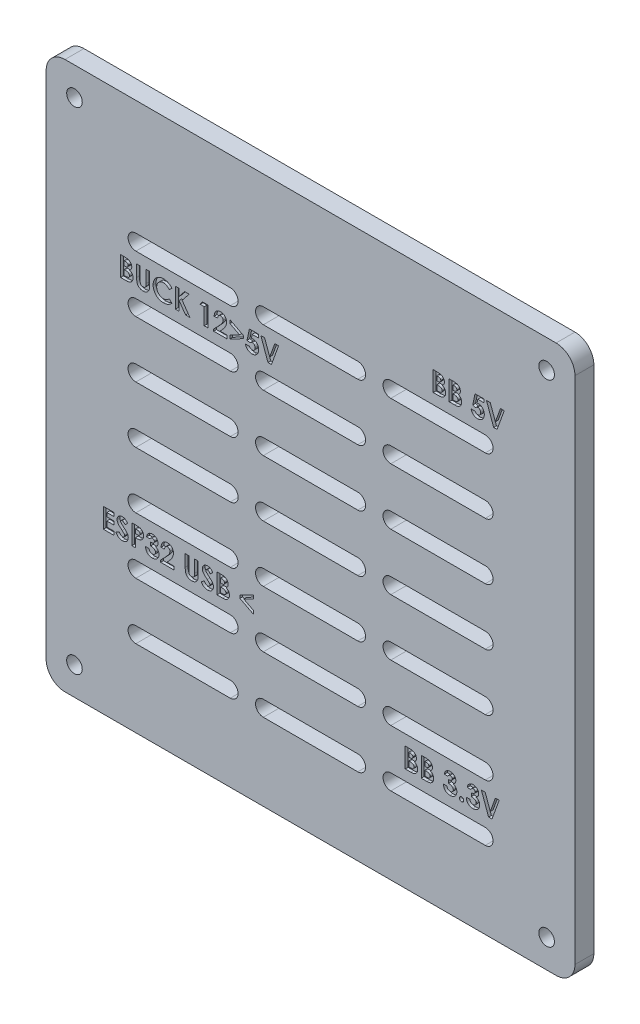
from build123d import *

# Parameters (mm, degrees)
PLATE_DEPTH          = 4
SKETCH2_R            = 1.65
MOUNTING_SLOTS_DEPTH = 166.795054209
ZONE_LABELS_DEPTH    = 0.6


with BuildPart() as part:
    # Sketch1 → Plate (new body)
    with BuildSketch(Plane.XY):
        with BuildLine():
            Line((-52, 40), (52, 40))
            ThreePointArc((52, 40), (54.828427125, 41.171572875), (56, 44))
            Line((56, 44), (56, 152))
            ThreePointArc((56, 152), (54.828427125, 154.828427125), (52, 156))
            Line((52, 156), (-52, 156))
            ThreePointArc((-52, 156), (-54.828427125, 154.828427125), (-56, 152))
            Line((-56, 152), (-56, 44))
            ThreePointArc((-56, 44), (-54.828427125, 41.171572875), (-52, 40))
        make_face()
    extrude(amount=PLATE_DEPTH)

    # Sketch2 → Mounting slots (cut, through all)
    with BuildSketch(Plane.XY):
        with Locations((-50, 46)):
            Circle(SKETCH2_R)
        with Locations((50, 46)):
            Circle(SKETCH2_R)
        with Locations((-50, 150)):
            Circle(SKETCH2_R)
        with Locations((50, 150)):
            Circle(SKETCH2_R)
        with BuildLine():
            Line((-37, 59.65), (-17, 59.65))
            ThreePointArc((-17, 59.65), (-15.35, 58), (-17, 56.35))
            Line((-17, 56.35), (-37, 56.35))
            ThreePointArc((-37, 56.35), (-38.65, 58), (-37, 59.65))
        make_face()
        with BuildLine():
            Line((-10, 59.65), (10, 59.65))
            ThreePointArc((10, 59.65), (11.65, 58), (10, 56.35))
            Line((10, 56.35), (-10, 56.35))
            ThreePointArc((-10, 56.35), (-11.65, 58), (-10, 59.65))
        make_face()
        with BuildLine():
            Line((17, 59.65), (37, 59.65))
            ThreePointArc((37, 59.65), (38.65, 58), (37, 56.35))
            Line((37, 56.35), (17, 56.35))
            ThreePointArc((17, 56.35), (15.35, 58), (17, 59.65))
        make_face()
        with BuildLine():
            Line((-37, 71.65), (-17, 71.65))
            ThreePointArc((-17, 71.65), (-15.35, 70), (-17, 68.35))
            Line((-17, 68.35), (-37, 68.35))
            ThreePointArc((-37, 68.35), (-38.65, 70), (-37, 71.65))
        make_face()
        with BuildLine():
            Line((-10, 71.65), (10, 71.65))
            ThreePointArc((10, 71.65), (11.65, 70), (10, 68.35))
            Line((10, 68.35), (-10, 68.35))
            ThreePointArc((-10, 68.35), (-11.65, 70), (-10, 71.65))
        make_face()
        with BuildLine():
            Line((17, 71.65), (37, 71.65))
            ThreePointArc((37, 71.65), (38.65, 70), (37, 68.35))
            Line((37, 68.35), (17, 68.35))
            ThreePointArc((17, 68.35), (15.35, 70), (17, 71.65))
        make_face()
        with BuildLine():
            Line((-37, 83.65), (-17, 83.65))
            ThreePointArc((-17, 83.65), (-15.35, 82), (-17, 80.35))
            Line((-17, 80.35), (-37, 80.35))
            ThreePointArc((-37, 80.35), (-38.65, 82), (-37, 83.65))
        make_face()
        with BuildLine():
            Line((-10, 83.65), (10, 83.65))
            ThreePointArc((10, 83.65), (11.65, 82), (10, 80.35))
            Line((10, 80.35), (-10, 80.35))
            ThreePointArc((-10, 80.35), (-11.65, 82), (-10, 83.65))
        make_face()
        with BuildLine():
            Line((17, 83.65), (37, 83.65))
            ThreePointArc((37, 83.65), (38.65, 82), (37, 80.35))
            Line((37, 80.35), (17, 80.35))
            ThreePointArc((17, 80.35), (15.35, 82), (17, 83.65))
        make_face()
        with BuildLine():
            Line((-37, 95.65), (-17, 95.65))
            ThreePointArc((-17, 95.65), (-15.35, 94), (-17, 92.35))
            Line((-17, 92.35), (-37, 92.35))
            ThreePointArc((-37, 92.35), (-38.65, 94), (-37, 95.65))
        make_face()
        with BuildLine():
            Line((-10, 95.65), (10, 95.65))
            ThreePointArc((10, 95.65), (11.65, 94), (10, 92.35))
            Line((10, 92.35), (-10, 92.35))
            ThreePointArc((-10, 92.35), (-11.65, 94), (-10, 95.65))
        make_face()
        with BuildLine():
            Line((17, 95.65), (37, 95.65))
            ThreePointArc((37, 95.65), (38.65, 94), (37, 92.35))
            Line((37, 92.35), (17, 92.35))
            ThreePointArc((17, 92.35), (15.35, 94), (17, 95.65))
        make_face()
        with BuildLine():
            Line((-37, 107.65), (-17, 107.65))
            ThreePointArc((-17, 107.65), (-15.35, 106), (-17, 104.35))
            Line((-17, 104.35), (-37, 104.35))
            ThreePointArc((-37, 104.35), (-38.65, 106), (-37, 107.65))
        make_face()
        with BuildLine():
            Line((-10, 107.65), (10, 107.65))
            ThreePointArc((10, 107.65), (11.65, 106), (10, 104.35))
            Line((10, 104.35), (-10, 104.35))
            ThreePointArc((-10, 104.35), (-11.65, 106), (-10, 107.65))
        make_face()
        with BuildLine():
            Line((17, 107.65), (37, 107.65))
            ThreePointArc((37, 107.65), (38.65, 106), (37, 104.35))
            Line((37, 104.35), (17, 104.35))
            ThreePointArc((17, 104.35), (15.35, 106), (17, 107.65))
        make_face()
        with BuildLine():
            Line((-37, 119.65), (-17, 119.65))
            ThreePointArc((-17, 119.65), (-15.35, 118), (-17, 116.35))
            Line((-17, 116.35), (-37, 116.35))
            ThreePointArc((-37, 116.35), (-38.65, 118), (-37, 119.65))
        make_face()
        with BuildLine():
            Line((-10, 119.65), (10, 119.65))
            ThreePointArc((10, 119.65), (11.65, 118), (10, 116.35))
            Line((10, 116.35), (-10, 116.35))
            ThreePointArc((-10, 116.35), (-11.65, 118), (-10, 119.65))
        make_face()
        with BuildLine():
            Line((17, 119.65), (37, 119.65))
            ThreePointArc((37, 119.65), (38.65, 118), (37, 116.35))
            Line((37, 116.35), (17, 116.35))
            ThreePointArc((17, 116.35), (15.35, 118), (17, 119.65))
        make_face()
        with BuildLine():
            Line((-37, 131.65), (-17, 131.65))
            ThreePointArc((-17, 131.65), (-15.35, 130), (-17, 128.35))
            Line((-17, 128.35), (-37, 128.35))
            ThreePointArc((-37, 128.35), (-38.65, 130), (-37, 131.65))
        make_face()
        with BuildLine():
            Line((-10, 131.65), (10, 131.65))
            ThreePointArc((10, 131.65), (11.65, 130), (10, 128.35))
            Line((10, 128.35), (-10, 128.35))
            ThreePointArc((-10, 128.35), (-11.65, 130), (-10, 131.65))
        make_face()
        with BuildLine():
            Line((17, 131.65), (37, 131.65))
            ThreePointArc((37, 131.65), (38.65, 130), (37, 128.35))
            Line((37, 128.35), (17, 128.35))
            ThreePointArc((17, 128.35), (15.35, 130), (17, 131.65))
        make_face()
    extrude(amount=MOUNTING_SLOTS_DEPTH, mode=Mode.SUBTRACT)

    # Sketch3 → Zone labels (cut)
    # profile 1 of 28: a face of its own
    with BuildSketch(Plane.XY.offset(4)):
        with BuildLine():
            Line((-40.232692308, 121.9), (-40.232692308, 126.1))
            Line((-40.232692308, 126.1), (-39.559615385, 126.1))
            add(Edge.make_bspline(
                [(-39.559615385, 126.1), (-39.512495791, 126.100005378), (-39.421320272, 126.100015783), (-39.289777792, 126.095396443), (-39.167783251, 126.089420809), (-39.055724883, 126.082735464), (-38.953411956, 126.07121528), (-38.861000055, 126.059074264), (-38.778304539, 126.044432947), (-38.727178395, 126.031299231), (-38.703125, 126.025120192)],
                knots=[0, 0, 0, 0, 1.311965854, 2.538629056, 3.664479157, 4.713267157, 5.663616078, 6.530575999, 7.308677837, 8, 8, 8, 8], degree=3))
            add(Edge.make_bspline(
                [(-38.703125, 126.025120192), (-38.67154045, 126.016404548), (-38.609561423, 125.999301655), (-38.520787678, 125.964761623), (-38.436573397, 125.92636793), (-38.357021404, 125.882567906), (-38.282620181, 125.832832763), (-38.213652476, 125.776767789), (-38.148630827, 125.716623427), (-38.089864005, 125.650723473), (-38.03674848, 125.581087965), (-37.990600612, 125.507735148), (-37.950504029, 125.431786635), (-37.918416261, 125.352286665), (-37.89423873, 125.269601356), (-37.876555385, 125.184083788), (-37.865094183, 125.095463362), (-37.864011249, 125.035171989), (-37.863461538, 125.004567308)],
                knots=[0, 0, 0, 0, 1.099996261, 2.158545794, 3.195537121, 4.207578794, 5.205712374, 6.197378256, 7.190519799, 8.17788031, 9.159561366, 10.129234751, 11.085776129, 12.040971148, 13.00380137, 13.975669004, 14.972423361, 16, 16, 16, 16], degree=3))
            add(Edge.make_bspline(
                [(-37.863461538, 125.004567308), (-37.864898869, 124.965248325), (-37.867728079, 124.887853738), (-37.88580126, 124.774175093), (-37.91969129, 124.666732434), (-37.96403557, 124.563545633), (-38.024329928, 124.464999578), (-38.100892101, 124.371141125), (-38.192482033, 124.279080231), (-38.262736567, 124.223895935), (-38.299278846, 124.195192308)],
                knots=[0, 0, 0, 0, 0.986156485, 1.941127874, 2.875419072, 3.804401753, 4.751181392, 5.761612777, 6.835722519, 8, 8, 8, 8], degree=3))
            add(Edge.make_bspline(
                [(-38.299278846, 124.195192308), (-38.269666736, 124.180075582), (-38.21160558, 124.150435866), (-38.129175797, 124.10171702), (-38.052854815, 124.049898348), (-37.982300435, 123.996022464), (-37.918992615, 123.93780549), (-37.860317271, 123.878601967), (-37.809169137, 123.815019782), (-37.763430935, 123.749325123), (-37.723676032, 123.680566724), (-37.689053896, 123.608860704), (-37.65980982, 123.533962098), (-37.63504518, 123.456252079), (-37.616575705, 123.375463363), (-37.604533214, 123.291567054), (-37.59531273, 123.204849283), (-37.594595463, 123.145779303), (-37.594230769, 123.115745192)],
                knots=[0, 0, 0, 0, 1.164658916, 2.283573913, 3.35186032, 4.395461096, 5.390182219, 6.362969632, 7.312859996, 8.245001507, 9.165155236, 10.092416118, 11.032087915, 11.979892451, 12.947605196, 13.931445124, 14.948243989, 16, 16, 16, 16], degree=3))
            add(Edge.make_bspline(
                [(-37.594230769, 123.115745192), (-37.59659739, 123.058381758), (-37.601267908, 122.945175249), (-37.635416453, 122.778962096), (-37.694619179, 122.62137695), (-37.774116233, 122.473046125), (-37.872071898, 122.338263552), (-37.984692822, 122.220195188), (-38.110845172, 122.120252939), (-38.227235962, 122.052799675), (-38.327904829, 122.007532227), (-38.411286971, 121.979545036), (-38.500837624, 121.953617744), (-38.598197141, 121.935411065), (-38.701600527, 121.918746309), (-38.81205597, 121.908457144), (-38.929357033, 121.901484431), (-39.009924474, 121.900504814), (-39.051442308, 121.9)],
                knots=[0, 0, 0, 0, 1.284142165, 2.534249414, 3.780121997, 5.041676246, 6.291546858, 7.49970053, 8.684500223, 9.883330709, 10.50184324, 11.153274765, 11.851151195, 12.587658647, 13.369265475, 14.195992086, 15.070362669, 16, 16, 16, 16], degree=3))
            Line((-39.051442308, 121.9), (-40.232692308, 121.9))
        make_face()
        with BuildLine():
            Line((-39.478846154, 125.346153846), (-39.478846154, 124.430769231))
            Line((-39.478846154, 124.430769231), (-39.278605769, 124.430769231))
            add(Edge.make_bspline(
                [(-39.278605769, 124.430769231), (-39.251391302, 124.431006551), (-39.19885542, 124.431464684), (-39.12297291, 124.437365275), (-39.052414431, 124.44743205), (-38.987447596, 124.461477733), (-38.927467214, 124.479313703), (-38.872856457, 124.500774216), (-38.82385544, 124.526958374), (-38.766927591, 124.565960833), (-38.70675075, 124.623354698), (-38.653777753, 124.706272027), (-38.622577012, 124.80162664), (-38.619102091, 124.868878097), (-38.617307692, 124.903605769)],
                knots=[0, 0, 0, 0, 1.065314748, 2.056525647, 2.977365736, 3.853934255, 4.656397591, 5.425096493, 6.14721249, 6.826394842, 8.123232004, 9.372140726, 10.643011755, 12, 12, 12, 12], degree=3))
            add(Edge.make_bspline(
                [(-38.617307692, 124.903605769), (-38.61874354, 124.936134004), (-38.621519693, 124.99902604), (-38.652934828, 125.087332059), (-38.701728743, 125.165589265), (-38.759336818, 125.219149922), (-38.813586015, 125.255730272), (-38.860037507, 125.279816875), (-38.911021506, 125.301378956), (-38.96752501, 125.317865848), (-39.029225353, 125.330237031), (-39.09582282, 125.339322184), (-39.167432316, 125.345505926), (-39.216893147, 125.34593324), (-39.242427885, 125.346153846)],
                knots=[0, 0, 0, 0, 1.347982417, 2.606269829, 3.849316587, 5.153353503, 5.842674298, 6.568177932, 7.326619318, 8.142485038, 9.012069166, 9.942760135, 10.937925643, 12, 12, 12, 12], degree=3))
            Line((-39.242427885, 125.346153846), (-39.478846154, 125.346153846))
        make_face(mode=Mode.SUBTRACT)
        with BuildLine():
            Line((-39.478846154, 123.730769231), (-39.478846154, 122.653846154))
            Line((-39.478846154, 122.653846154), (-39.261778846, 122.653846154))
            add(Edge.make_bspline(
                [(-39.261778846, 122.653846154), (-39.218864363, 122.654091323), (-39.136355914, 122.65456269), (-39.018162707, 122.660257933), (-38.910695534, 122.670522605), (-38.814239142, 122.68333722), (-38.728645789, 122.70069902), (-38.654204803, 122.722772324), (-38.58989532, 122.747056802), (-38.536102944, 122.777051017), (-38.492157655, 122.811956844), (-38.452501639, 122.847631438), (-38.420168594, 122.888785453), (-38.394586086, 122.93365226), (-38.37244447, 122.981117336), (-38.359090211, 123.033034176), (-38.348922747, 123.087864088), (-38.348363204, 123.125788752), (-38.348076923, 123.145192308)],
                knots=[0, 0, 0, 0, 1.753078804, 3.370512758, 4.83203934, 6.162291463, 7.344201807, 8.395507345, 9.331626367, 10.147333109, 10.898971645, 11.62040215, 12.321813352, 13.025280112, 13.727906689, 14.453419512, 15.208716525, 16, 16, 16, 16], degree=3))
            add(Edge.make_bspline(
                [(-38.348076923, 123.145192308), (-38.348708255, 123.167380578), (-38.349937921, 123.210597361), (-38.359980613, 123.273763301), (-38.378231465, 123.332732897), (-38.401219303, 123.389014081), (-38.433208102, 123.440591791), (-38.471225696, 123.489250936), (-38.517160655, 123.533343766), (-38.568817196, 123.575537182), (-38.629069437, 123.612479803), (-38.697945647, 123.64453407), (-38.775819997, 123.671304614), (-38.862933714, 123.692619339), (-38.958904896, 123.710708851), (-39.064434028, 123.721510287), (-39.178642226, 123.729543789), (-39.25783605, 123.730351469), (-39.298798077, 123.730769231)],
                knots=[0, 0, 0, 0, 0.845221588, 1.646264278, 2.427170338, 3.19324141, 3.95557735, 4.731569926, 5.540061037, 6.376114724, 7.268642756, 8.224665384, 9.265483498, 10.400594375, 11.639216012, 12.983232105, 14.439614077, 16, 16, 16, 16], degree=3))
            Line((-39.298798077, 123.730769231), (-39.478846154, 123.730769231))
        make_face(mode=Mode.SUBTRACT)
    # profile 2 of 28: a face of its own
    with BuildSketch(Plane.XY.offset(4)):
        with BuildLine():
            Line((-36.840384615, 126.1), (-36.086538462, 126.1))
            Line((-36.086538462, 126.1), (-36.086538462, 123.367307692))
            add(Edge.make_bspline(
                [(-36.086538462, 123.367307692), (-36.086497471, 123.338976324), (-36.086418299, 123.284254578), (-36.082454877, 123.205746789), (-36.078828072, 123.133581693), (-36.072284288, 123.067838296), (-36.062616876, 123.008488474), (-36.053255666, 122.955150986), (-36.040586195, 122.908780779), (-36.021546005, 122.855999344), (-35.992211322, 122.796696518), (-35.944280078, 122.734889752), (-35.888971523, 122.678482108), (-35.822681034, 122.631530522), (-35.748176387, 122.593550921), (-35.665866952, 122.56541224), (-35.575868755, 122.549770869), (-35.513639939, 122.547382927), (-35.481610577, 122.546153846)],
                knots=[0, 0, 0, 0, 1.155499968, 2.231836252, 3.205919964, 4.102923608, 4.924856345, 5.658536265, 6.31071849, 6.882491295, 7.94666036, 8.992281882, 10.060072772, 11.158554251, 12.289267114, 13.461410017, 14.693379945, 16, 16, 16, 16], degree=3))
            add(Edge.make_bspline(
                [(-35.481610577, 122.546153846), (-35.447583332, 122.547146786), (-35.381235965, 122.54908285), (-35.28580584, 122.568087415), (-35.197389288, 122.598349193), (-35.117858388, 122.641540461), (-35.047292288, 122.693312765), (-34.987559563, 122.752349416), (-34.940418716, 122.818768162), (-34.909694065, 122.880044513), (-34.892443687, 122.936444058), (-34.879513669, 122.986834911), (-34.870034536, 123.04629113), (-34.861434755, 123.113884177), (-34.856266949, 123.190314187), (-34.850663305, 123.274966499), (-34.848609518, 123.368420327), (-34.848259465, 123.433493982), (-34.848076923, 123.467427885)],
                knots=[0, 0, 0, 0, 1.261321664, 2.459363699, 3.594844139, 4.716940403, 5.803436589, 6.833651888, 7.818396249, 8.814403945, 9.360733334, 10.004355033, 10.743453831, 11.592799886, 12.532235708, 13.585170094, 14.740740724, 16, 16, 16, 16], degree=3))
            Line((-34.848076923, 123.467427885), (-34.848076923, 126.1))
            Line((-34.848076923, 126.1), (-34.094230769, 126.1))
            Line((-34.094230769, 126.1), (-34.094230769, 123.594471154))
            add(Edge.make_bspline(
                [(-34.094230769, 123.594471154), (-34.094335454, 123.543709259), (-34.094536754, 123.446099086), (-34.097628108, 123.305826399), (-34.10420904, 123.1777098), (-34.109736264, 123.061711853), (-34.120433336, 122.957988828), (-34.131577175, 122.866097798), (-34.145780957, 122.786364402), (-34.166915331, 122.695597621), (-34.203387003, 122.591082997), (-34.26218412, 122.470738938), (-34.336823254, 122.352914815), (-34.42504298, 122.238906774), (-34.524651121, 122.132996978), (-34.63343915, 122.040021886), (-34.749678697, 121.961374984), (-34.874584381, 121.898979283), (-35.008049901, 121.85031534), (-35.151395799, 121.817615622), (-35.304524325, 121.795523282), (-35.410293091, 121.793401041), (-35.464783654, 121.792307692)],
                knots=[0, 0, 0, 0, 1.170808336, 2.251350247, 3.235597562, 4.129743112, 4.929140599, 5.639994148, 6.264258765, 6.79612947, 7.788252245, 8.809469599, 9.879094798, 10.999557536, 12.129761673, 13.226370002, 14.293821979, 15.358369427, 16.438775801, 17.562147481, 18.744053101, 20, 20, 20, 20], degree=3))
            add(Edge.make_bspline(
                [(-35.464783654, 121.792307692), (-35.500988268, 121.792917511), (-35.572419228, 121.794120671), (-35.677470986, 121.804729401), (-35.779024146, 121.82036268), (-35.876887891, 121.843170025), (-35.971401887, 121.872632853), (-36.062541024, 121.908899544), (-36.149966608, 121.951767805), (-36.233189416, 122.000843341), (-36.312107037, 122.053910086), (-36.384233668, 122.112736806), (-36.452051357, 122.172973044), (-36.51360088, 122.237153795), (-36.569344526, 122.304605273), (-36.619167494, 122.375480343), (-36.662995761, 122.449772711), (-36.701931805, 122.528821492), (-36.735257258, 122.616644449), (-36.763351867, 122.716365483), (-36.787895979, 122.829547621), (-36.806135714, 122.956445855), (-36.822671966, 123.096641943), (-36.833138501, 123.250501119), (-36.838614017, 123.418027795), (-36.839779503, 123.534170567), (-36.840384615, 123.594471154)],
                knots=[0, 0, 0, 0, 1.001158378, 1.975264943, 2.917723546, 3.841610987, 4.75185031, 5.653588123, 6.552117133, 7.442167995, 8.324307438, 9.179605724, 10.014504199, 10.831958861, 11.636465792, 12.43274043, 13.225645099, 14.020104002, 14.867201867, 15.819789774, 16.883317127, 18.068162734, 19.364263498, 20.787406516, 22.332041935, 24, 24, 24, 24], degree=3))
            Line((-36.840384615, 123.594471154), (-36.840384615, 126.1))
        make_face()
    # profile 3 of 28: a face of its own
    with BuildSketch(Plane.XY.offset(4)):
        with BuildLine():
            Line((-29.355769231, 125.371394231), (-29.908533654, 124.843028846))
            add(Edge.make_bspline(
                [(-29.908533654, 124.843028846), (-29.955423635, 124.891513166), (-30.04701446, 124.986218232), (-30.194601746, 125.111599393), (-30.348087149, 125.216087626), (-30.504484919, 125.30408695), (-30.666608196, 125.370664711), (-30.832582395, 125.419181047), (-31.003467309, 125.448759623), (-31.119115646, 125.452143936), (-31.177283654, 125.453846154)],
                knots=[0, 0, 0, 0, 1.115251505, 2.178435587, 3.19620269, 4.182487026, 5.141301733, 6.088180966, 7.038406374, 8, 8, 8, 8], degree=3))
            add(Edge.make_bspline(
                [(-31.177283654, 125.453846154), (-31.225861009, 125.452501342), (-31.321723067, 125.449847504), (-31.462473689, 125.430392251), (-31.597108933, 125.397307748), (-31.726089677, 125.351711175), (-31.849036389, 125.292711628), (-31.966206843, 125.220354774), (-32.07731216, 125.135294096), (-32.180884702, 125.037969702), (-32.275629224, 124.931635489), (-32.359342042, 124.818177137), (-32.429464955, 124.697854573), (-32.487013689, 124.571886336), (-32.531841928, 124.439689382), (-32.563854923, 124.301352711), (-32.582370384, 124.156711576), (-32.585133941, 124.05838561), (-32.586538462, 124.008413462)],
                knots=[0, 0, 0, 0, 1.035432265, 2.043311493, 3.022114605, 3.98653278, 4.95457646, 5.923598177, 6.917315552, 7.932509744, 8.948865224, 9.949768934, 10.933144597, 11.912367597, 12.897413939, 13.903909035, 14.934704909, 16, 16, 16, 16], degree=3))
            add(Edge.make_bspline(
                [(-32.586538462, 124.008413462), (-32.586133695, 123.973339511), (-32.585335891, 123.904208035), (-32.576602517, 123.801943394), (-32.562539726, 123.702722516), (-32.542187384, 123.606695694), (-32.51673658, 123.513779711), (-32.486876991, 123.423172984), (-32.449418577, 123.336127494), (-32.407839171, 123.251632266), (-32.359482802, 123.171992856), (-32.307345716, 123.09605007), (-32.250811557, 123.02417617), (-32.189514152, 122.95666498), (-32.122590816, 122.894571549), (-32.051771269, 122.836028653), (-31.975860884, 122.782501819), (-31.896436511, 122.732647732), (-31.812812025, 122.689339062), (-31.727256351, 122.650109774), (-31.638472294, 122.61824976), (-31.547540851, 122.592567682), (-31.454786981, 122.570728911), (-31.359303465, 122.557282108), (-31.261918024, 122.547099001), (-31.196101812, 122.546470254), (-31.162980769, 122.546153846)],
                knots=[0, 0, 0, 0, 1.103660481, 2.175337485, 3.227646561, 4.255952547, 5.262355991, 6.258840057, 7.255597736, 8.242457506, 9.22035537, 10.185017736, 11.140346927, 12.096287581, 13.051739095, 14.01125915, 14.986044842, 15.97314143, 16.960198552, 17.947847494, 18.933482797, 19.925264591, 20.920966487, 21.929612487, 22.958107872, 24, 24, 24, 24], degree=3))
            add(Edge.make_bspline(
                [(-31.162980769, 122.546153846), (-31.106801789, 122.54777884), (-30.996424701, 122.550971532), (-30.834430454, 122.575937924), (-30.680066076, 122.617006227), (-30.556729676, 122.665505506), (-30.460098864, 122.713399174), (-30.386535256, 122.757698458), (-30.310464752, 122.807252071), (-30.233150817, 122.86393022), (-30.153723824, 122.927052745), (-30.073585841, 122.998002146), (-29.990685323, 123.074442162), (-29.936378016, 123.128998903), (-29.908533654, 123.156971154)],
                knots=[0, 0, 0, 0, 1.404581149, 2.759636711, 4.088442092, 5.392261763, 6.066678138, 6.783632037, 7.538459478, 8.336747902, 9.180226004, 10.074962426, 11.012997595, 12, 12, 12, 12], degree=3))
            Line((-29.908533654, 123.156971154), (-29.372596154, 122.594110577))
            add(Edge.make_bspline(
                [(-29.372596154, 122.594110577), (-29.410269675, 122.557737975), (-29.483800333, 122.486746433), (-29.594719288, 122.38594507), (-29.705498647, 122.295363838), (-29.813462212, 122.211715038), (-29.920378538, 122.137435562), (-30.026236288, 122.072451226), (-30.129837104, 122.015118482), (-30.233332292, 121.966404219), (-30.337365851, 121.92504075), (-30.444404158, 121.889429518), (-30.554774438, 121.859303697), (-30.669150784, 121.834996116), (-30.786466362, 121.815504717), (-30.907819091, 121.802348136), (-31.032439533, 121.793503404), (-31.116971509, 121.792708631), (-31.159615385, 121.792307692)],
                knots=[0, 0, 0, 0, 1.244526981, 2.429050516, 3.560637417, 4.644440555, 5.67424972, 6.652764056, 7.595344123, 8.486817594, 9.369275933, 10.254498637, 11.166417451, 12.086725134, 13.032340136, 13.991389299, 14.986715468, 16, 16, 16, 16], degree=3))
            add(Edge.make_bspline(
                [(-31.159615385, 121.792307692), (-31.237946901, 121.794304519), (-31.391219906, 121.798211753), (-31.615837498, 121.827161716), (-31.829218181, 121.875695818), (-32.03188107, 121.944336426), (-32.223761723, 122.032021585), (-32.404811051, 122.139519473), (-32.574737244, 122.266544485), (-32.73216763, 122.411607763), (-32.874570908, 122.571817977), (-33.000438914, 122.743839794), (-33.104556933, 122.928518639), (-33.191008368, 123.123126215), (-33.258612253, 123.328550593), (-33.306193928, 123.545013979), (-33.335537199, 123.772307364), (-33.338747395, 123.927553985), (-33.340384615, 124.006730769)],
                knots=[0, 0, 0, 0, 1.078019885, 2.10938526, 3.111377082, 4.085535484, 5.04941344, 6.010039228, 6.978205633, 7.964457913, 8.951525778, 9.924444315, 10.892603023, 11.863865945, 12.85144698, 13.863884204, 14.910567087, 16, 16, 16, 16], degree=3))
            add(Edge.make_bspline(
                [(-33.340384615, 124.006730769), (-33.339692805, 124.058369192), (-33.338321807, 124.160703926), (-33.323912486, 124.311451279), (-33.303825055, 124.458402984), (-33.271958172, 124.600033195), (-33.233545788, 124.738249932), (-33.185774941, 124.871550941), (-33.128721928, 125.000319342), (-33.064225703, 125.124770701), (-32.991261769, 125.244089728), (-32.909753044, 125.357251285), (-32.821797881, 125.465128958), (-32.725282862, 125.56629155), (-32.621610474, 125.661627288), (-32.510312651, 125.75061953), (-32.392058792, 125.834544524), (-32.266528828, 125.911238048), (-32.136161472, 125.980611417), (-32.002600999, 126.041801691), (-31.866175553, 126.09294267), (-31.727461951, 126.135362225), (-31.585874131, 126.167025423), (-31.442422711, 126.190993443), (-31.295887092, 126.204391719), (-31.197501118, 126.206585102), (-31.147836538, 126.207692308)],
                knots=[0, 0, 0, 0, 1.071919942, 2.124283339, 3.142214191, 4.149696895, 5.136002878, 6.119640489, 7.086990633, 8.058538607, 9.028339693, 9.988281803, 10.952401235, 11.916291999, 12.888973767, 13.874849856, 14.873389453, 15.898127285, 16.927174885, 17.938320013, 18.946391617, 19.950418109, 20.947802303, 21.956882652, 22.968648068, 24, 24, 24, 24], degree=3))
            add(Edge.make_bspline(
                [(-31.147836538, 126.207692308), (-31.10546756, 126.20705763), (-31.021170122, 126.205794874), (-30.895637091, 126.195268425), (-30.771108015, 126.178736744), (-30.648028745, 126.153793958), (-30.525518893, 126.124183719), (-30.405188376, 126.085413195), (-30.285138915, 126.04219614), (-30.167253307, 125.990538975), (-30.051367001, 125.934150514), (-29.940194817, 125.870175756), (-29.831870183, 125.802551638), (-29.728793509, 125.727275867), (-29.629033947, 125.647078837), (-29.533113147, 125.561586381), (-29.441872872, 125.469373092), (-29.384615541, 125.404218959), (-29.355769231, 125.371394231)],
                knots=[0, 0, 0, 0, 0.996412454, 1.982464992, 2.961075852, 3.949442424, 4.934965278, 5.923860011, 6.921385422, 7.934793307, 8.949617135, 9.951082467, 10.950285876, 11.951772932, 12.951063433, 13.960125323, 14.972308753, 16, 16, 16, 16], degree=3))
        make_face()
    # profile 4 of 28: a face of its own
    with BuildSketch(Plane.XY.offset(4)):
        Polygon((-28.601923077, 126.1), (-27.848076923, 126.1), (-27.848076923, 124.621754808), (-26.656730769, 126.1), (-25.705168269, 126.1), (-27.201923077, 124.242307692), (-25.559615385, 121.9), (-26.467427885, 121.9), (-27.848076923, 123.869591346), (-27.848076923, 121.9), (-28.601923077, 121.9), align=None)
    # profile 5 of 28: a face of its own
    with BuildSketch(Plane.XY.offset(4)):
        Polygon((-22.928725962, 126.1), (-21.763461538, 126.1), (-21.763461538, 121.9), (-22.517307692, 121.9), (-22.517307692, 125.4), (-23.378846154, 125.4), align=None)
    # profile 6 of 28: a face of its own
    with BuildSketch(Plane.XY.offset(4)):
        with BuildLine():
            Line((-19.663461538, 124.7), (-20.417307692, 124.7))
            add(Edge.make_bspline(
                [(-20.417307692, 124.7), (-20.414051946, 124.757024473), (-20.407690414, 124.868446871), (-20.382385848, 125.03029147), (-20.348478597, 125.18321682), (-20.303224869, 125.32668797), (-20.246360599, 125.460652787), (-20.179349052, 125.585567966), (-20.100478233, 125.700775824), (-20.011426774, 125.805720764), (-19.913706524, 125.899867839), (-19.80934625, 125.98334455), (-19.696749622, 126.05222743), (-19.577973873, 126.108911664), (-19.453039226, 126.154199733), (-19.320763605, 126.184478472), (-19.182292324, 126.20498353), (-19.087497518, 126.206777805), (-19.039182692, 126.207692308)],
                knots=[0, 0, 0, 0, 1.199038563, 2.342849363, 3.436047546, 4.486744587, 5.497670872, 6.488682221, 7.459191391, 8.424610317, 9.374430501, 10.305433194, 11.225809216, 12.140057399, 13.06607119, 14.010487599, 14.985989317, 16, 16, 16, 16], degree=3))
            add(Edge.make_bspline(
                [(-19.039182692, 126.207692308), (-18.979876929, 126.205841812), (-18.86409818, 126.202229209), (-18.695862476, 126.171412514), (-18.538748722, 126.119866829), (-18.392871125, 126.047843913), (-18.259471568, 125.956346347), (-18.138572172, 125.847250476), (-18.033829127, 125.718267408), (-17.944578332, 125.574763921), (-17.870421588, 125.422813924), (-17.818455631, 125.265691326), (-17.784298966, 125.107565524), (-17.780655946, 125.001091613), (-17.778846154, 124.948197115)],
                knots=[0, 0, 0, 0, 1.075374347, 2.099382735, 3.09057751, 4.06680945, 5.040638231, 6.016817125, 7.011024321, 8.044445721, 9.0776792, 10.070479129, 11.0414456, 12, 12, 12, 12], degree=3))
            add(Edge.make_bspline(
                [(-17.778846154, 124.948197115), (-17.779550791, 124.916202785), (-17.780969053, 124.851806101), (-17.790830414, 124.754358113), (-17.805624404, 124.655095944), (-17.827930135, 124.554104702), (-17.855747211, 124.451356078), (-17.889493345, 124.346542581), (-17.929951312, 124.240258464), (-17.976445949, 124.131307517), (-18.03191417, 124.019336021), (-18.096499203, 123.902665479), (-18.171915281, 123.781399386), (-18.257251473, 123.654853034), (-18.352922237, 123.523226008), (-18.459394605, 123.386914808), (-18.575442267, 123.245439118), (-18.657804557, 123.150870558), (-18.700120192, 123.102283654)],
                knots=[0, 0, 0, 0, 0.728284026, 1.46585585, 2.227944881, 3.01186502, 3.81876927, 4.650621989, 5.517437689, 6.406905708, 7.346299482, 8.360816762, 9.441613733, 10.596154504, 11.834900912, 13.145207542, 14.533280747, 16, 16, 16, 16], degree=3))
            Line((-18.700120192, 123.102283654), (-19.138461538, 122.6))
            Line((-19.138461538, 122.6), (-17.725, 122.6))
            Line((-17.725, 122.6), (-17.725, 121.9))
            Line((-17.725, 121.9), (-20.525, 121.9))
            Line((-20.525, 121.9), (-20.525, 122.281971154))
            Line((-20.525, 122.281971154), (-19.281490385, 123.605408654))
            add(Edge.make_bspline(
                [(-19.281490385, 123.605408654), (-19.245487586, 123.644013737), (-19.175760841, 123.718780334), (-19.076546869, 123.828583035), (-18.986766988, 123.932783178), (-18.908282858, 124.032490284), (-18.836975732, 124.12447026), (-18.776025189, 124.211495496), (-18.72487358, 124.292779254), (-18.669341253, 124.39079327), (-18.616603797, 124.507692426), (-18.568213989, 124.642365047), (-18.538717053, 124.771081056), (-18.534645543, 124.854955175), (-18.532692308, 124.895192308)],
                knots=[0, 0, 0, 0, 1.246127091, 2.413378631, 3.493388633, 4.492180848, 5.408488754, 6.240484944, 6.999099869, 7.674939598, 8.898438119, 10.020720584, 11.050475521, 12, 12, 12, 12], degree=3))
            add(Edge.make_bspline(
                [(-18.532692308, 124.895192308), (-18.534152695, 124.934118629), (-18.536982428, 125.009544619), (-18.568078908, 125.116837687), (-18.616254653, 125.213980608), (-18.684141082, 125.298070641), (-18.76637281, 125.367172997), (-18.861399295, 125.418569388), (-18.968445793, 125.44822487), (-19.043487427, 125.451936677), (-19.082091346, 125.453846154)],
                knots=[0, 0, 0, 0, 1.062038974, 2.057870785, 3.028805853, 4.01125022, 4.991535629, 5.949134679, 6.94496649, 8, 8, 8, 8], degree=3))
            add(Edge.make_bspline(
                [(-19.082091346, 125.453846154), (-19.102034623, 125.45314077), (-19.141296165, 125.451752109), (-19.199007563, 125.442508167), (-19.253924105, 125.426216684), (-19.306657042, 125.40438839), (-19.356643594, 125.375454829), (-19.403757679, 125.339789606), (-19.448495705, 125.298299055), (-19.490652484, 125.251112911), (-19.529020656, 125.19845316), (-19.563099126, 125.140800743), (-19.591276347, 125.078191444), (-19.616084597, 125.011451802), (-19.635217907, 124.939864981), (-19.649149329, 124.863859417), (-19.65974046, 124.783558763), (-19.662198615, 124.728359615), (-19.663461538, 124.7)],
                knots=[0, 0, 0, 0, 0.903469896, 1.778625579, 2.63899355, 3.493148037, 4.358286772, 5.247621495, 6.164656832, 7.118446693, 8.109501108, 9.111810964, 10.146451449, 11.215617525, 12.33435995, 13.498009769, 14.714554818, 16, 16, 16, 16], degree=3))
        make_face()
    # profile 7 of 28: a face of its own
    with BuildSketch(Plane.XY.offset(4)):
        Polygon((-17.078846154, 125.023076923), (-17.078846154, 125.743269231), (-14.225, 124.271754808), (-14.225, 123.674399038), (-17.078846154, 122.203725962), (-17.078846154, 122.923076923), (-15.041947115, 123.973076923), align=None)
    # profile 8 of 28: a face of its own
    with BuildSketch(Plane.XY.offset(4)):
        with BuildLine():
            Line((-12.960456731, 126.1), (-11.048076923, 126.1))
            Line((-11.048076923, 126.1), (-11.048076923, 125.4))
            Line((-11.048076923, 125.4), (-12.363100962, 125.4))
            Line((-12.363100962, 125.4), (-12.527163462, 124.605769231))
            add(Edge.make_bspline(
                [(-12.527163462, 124.605769231), (-12.504807597, 124.611995621), (-12.46071724, 124.624275342), (-12.394295062, 124.636590349), (-12.329922715, 124.644572545), (-12.287681974, 124.645637263), (-12.2671875, 124.646153846)],
                knots=[0, 0, 0, 0, 1.05461699, 2.079921384, 3.068411212, 4, 4, 4, 4], degree=3))
            add(Edge.make_bspline(
                [(-12.2671875, 124.646153846), (-12.222527895, 124.645130497), (-12.134493974, 124.643113251), (-12.00571152, 124.623963004), (-11.882394712, 124.593801945), (-11.764920914, 124.550786053), (-11.653404881, 124.494799758), (-11.547711435, 124.427072035), (-11.447710855, 124.34748393), (-11.355179571, 124.255985614), (-11.270157962, 124.155518391), (-11.196236522, 124.046852459), (-11.133103, 123.931537288), (-11.082888779, 123.808856081), (-11.043255435, 123.67957936), (-11.014615495, 123.543624279), (-10.997679268, 123.400829712), (-10.995395522, 123.303411189), (-10.994230769, 123.253725962)],
                knots=[0, 0, 0, 0, 1.01440847, 1.999622559, 2.951875003, 3.895578053, 4.836219714, 5.782137149, 6.743708247, 7.735272588, 8.734977101, 9.730283169, 10.717124674, 11.717316708, 12.737475749, 13.78628267, 14.87096371, 16, 16, 16, 16], degree=3))
            add(Edge.make_bspline(
                [(-10.994230769, 123.253725962), (-10.995654115, 123.203476692), (-10.998462793, 123.104320194), (-11.016786844, 122.958525069), (-11.049129121, 122.818886253), (-11.093554476, 122.685029935), (-11.152082036, 122.557939929), (-11.222469438, 122.436299676), (-11.305906743, 122.321012074), (-11.401575144, 122.213258959), (-11.505579245, 122.114770544), (-11.616319061, 122.028130097), (-11.733016613, 121.955222862), (-11.855674716, 121.89630149), (-11.98358964, 121.84968395), (-12.116800211, 121.815748606), (-12.255953814, 121.796288572), (-12.35042103, 121.793649234), (-12.3984375, 121.792307692)],
                knots=[0, 0, 0, 0, 1.06808661, 2.107647099, 3.116961351, 4.110378221, 5.100014249, 6.085620622, 7.093190682, 8.119403071, 9.144090782, 10.133780668, 11.103064255, 12.062861538, 13.020824475, 13.992378307, 14.979551724, 16, 16, 16, 16], degree=3))
            add(Edge.make_bspline(
                [(-12.3984375, 121.792307692), (-12.4413772, 121.793405157), (-12.526063275, 121.795569586), (-12.650802146, 121.808873311), (-12.771064269, 121.832394422), (-12.886211184, 121.866435559), (-12.99745443, 121.908332427), (-13.103508002, 121.960732379), (-13.204954683, 122.022637648), (-13.301506403, 122.092918463), (-13.391594334, 122.172087074), (-13.473817051, 122.25875076), (-13.548672342, 122.351817166), (-13.61455842, 122.45243445), (-13.671268752, 122.560453954), (-13.721560632, 122.674602645), (-13.762725039, 122.796072599), (-13.78361479, 122.880282319), (-13.794230769, 122.923076923)],
                knots=[0, 0, 0, 0, 1.054957082, 2.080596141, 3.077793124, 4.061112343, 5.027190972, 5.994718051, 6.962465889, 7.943658696, 8.924948258, 9.904494768, 10.875059, 11.855380583, 12.854004648, 13.869083016, 14.917087635, 16, 16, 16, 16], degree=3))
            Line((-13.794230769, 122.923076923), (-12.932692308, 122.923076923))
            add(Edge.make_bspline(
                [(-12.932692308, 122.923076923), (-12.916943364, 122.893422005), (-12.886337089, 122.835791057), (-12.828117187, 122.759277314), (-12.762943703, 122.694029681), (-12.691404538, 122.639410675), (-12.613036161, 122.598491044), (-12.531031937, 122.56745949), (-12.44436168, 122.549527504), (-12.385335409, 122.547285828), (-12.355528846, 122.546153846)],
                knots=[0, 0, 0, 0, 1.104910296, 2.147267069, 3.153527244, 4.136738762, 5.099945312, 6.05603338, 7.018353, 8, 8, 8, 8], degree=3))
            add(Edge.make_bspline(
                [(-12.355528846, 122.546153846), (-12.334754072, 122.546935489), (-12.293879354, 122.548473386), (-12.233656921, 122.556609242), (-12.176171962, 122.57201837), (-12.120997091, 122.593356431), (-12.067984095, 122.619967402), (-12.017892933, 122.65356202), (-11.969852108, 122.69223067), (-11.924592998, 122.736603077), (-11.88360129, 122.78606799), (-11.847656045, 122.839221411), (-11.81551604, 122.894882259), (-11.791709446, 122.955255401), (-11.772213859, 123.018538073), (-11.75785652, 123.085207635), (-11.749276391, 123.155341953), (-11.748482101, 123.203220686), (-11.748076923, 123.227644231)],
                knots=[0, 0, 0, 0, 0.978869489, 1.925942215, 2.855067702, 3.774946051, 4.70828698, 5.642468714, 6.60995405, 7.609372294, 8.622401667, 9.629904756, 10.629323, 11.642352373, 12.678539694, 13.745912462, 14.850161547, 16, 16, 16, 16], degree=3))
            add(Edge.make_bspline(
                [(-11.748076923, 123.227644231), (-11.748547179, 123.25150085), (-11.749462542, 123.297938338), (-11.757034613, 123.366125203), (-11.770580901, 123.430822199), (-11.789037835, 123.492524855), (-11.812664914, 123.550858483), (-11.841538784, 123.606170312), (-11.875782798, 123.658180763), (-11.915580803, 123.705830952), (-11.958020986, 123.749537061), (-12.00361538, 123.787762076), (-12.051953203, 123.819486184), (-12.101532418, 123.847182253), (-12.154332048, 123.867338849), (-12.209164841, 123.881219952), (-12.265973133, 123.891405348), (-12.304720837, 123.892003777), (-12.324399038, 123.892307692)],
                knots=[0, 0, 0, 0, 1.166249705, 2.270133367, 3.348514167, 4.393962215, 5.415026464, 6.420877785, 7.440098956, 8.453121383, 9.451844239, 10.415694839, 11.355045125, 12.27538808, 13.187007209, 14.108269027, 15.039275622, 16, 16, 16, 16], degree=3))
            add(Edge.make_bspline(
                [(-12.324399038, 123.892307692), (-12.345774139, 123.891496626), (-12.388614426, 123.889871075), (-12.45226437, 123.876644402), (-12.515146872, 123.855238682), (-12.577611625, 123.8257061), (-12.639038557, 123.787057269), (-12.701048755, 123.741726621), (-12.761566604, 123.686420454), (-12.800045536, 123.645228295), (-12.819951923, 123.623918269)],
                knots=[0, 0, 0, 0, 0.88288272, 1.769486374, 2.674910571, 3.623812639, 4.617874466, 5.670434592, 6.794841017, 8, 8, 8, 8], degree=3))
            Line((-12.819951923, 123.623918269), (-13.454326923, 123.769471154))
            Line((-13.454326923, 123.769471154), (-12.960456731, 126.1))
        make_face()
    # profile 9 of 28: a face of its own
    with BuildSketch(Plane.XY.offset(4)):
        Polygon((-10.536538462, 126.1), (-9.731370192, 126.1), (-8.651923077, 123.116586538), (-7.571634615, 126.1), (-6.767307692, 126.1), (-8.289302885, 121.9), (-9.016225962, 121.9), align=None)
    # profile 10 of 28: a face of its own
    with BuildSketch(Plane.XY.offset(4)):
        with BuildLine():
            Line((25.975, 133.9), (25.975, 138.1))
            Line((25.975, 138.1), (26.648076923, 138.1))
            add(Edge.make_bspline(
                [(26.648076923, 138.1), (26.695196516, 138.100005378), (26.786372036, 138.100015783), (26.917914516, 138.095396443), (27.039909057, 138.089420809), (27.151967425, 138.082735464), (27.254280352, 138.07121528), (27.346692253, 138.059074264), (27.429387769, 138.044432947), (27.480513912, 138.031299231), (27.504567308, 138.025120192)],
                knots=[0, 0, 0, 0, 1.311965854, 2.538629056, 3.664479157, 4.713267157, 5.663616078, 6.530575999, 7.308677837, 8, 8, 8, 8], degree=3))
            add(Edge.make_bspline(
                [(27.504567308, 138.025120192), (27.536151858, 138.016404548), (27.598130885, 137.999301655), (27.68690463, 137.964761623), (27.771118911, 137.92636793), (27.850670903, 137.882567906), (27.925072127, 137.832832763), (27.994039832, 137.776767789), (28.059061481, 137.716623427), (28.117828303, 137.650723473), (28.170943828, 137.581087965), (28.217091696, 137.507735148), (28.257188278, 137.431786635), (28.289276047, 137.352286665), (28.313453578, 137.269601356), (28.331136923, 137.184083788), (28.342598125, 137.095463362), (28.343681058, 137.035171989), (28.344230769, 137.004567308)],
                knots=[0, 0, 0, 0, 1.099996261, 2.158545794, 3.195537121, 4.207578794, 5.205712374, 6.197378256, 7.190519799, 8.17788031, 9.159561366, 10.129234751, 11.085776129, 12.040971148, 13.00380137, 13.975669004, 14.972423361, 16, 16, 16, 16], degree=3))
            add(Edge.make_bspline(
                [(28.344230769, 137.004567308), (28.342793438, 136.965248325), (28.339964229, 136.887853738), (28.321891048, 136.774175093), (28.288001018, 136.666732434), (28.243656737, 136.563545633), (28.18336238, 136.464999578), (28.106800207, 136.371141125), (28.015210275, 136.279080231), (27.944955741, 136.223895935), (27.908413462, 136.195192308)],
                knots=[0, 0, 0, 0, 0.986156485, 1.941127874, 2.875419072, 3.804401753, 4.751181392, 5.761612777, 6.835722519, 8, 8, 8, 8], degree=3))
            add(Edge.make_bspline(
                [(27.908413462, 136.195192308), (27.938025572, 136.180075582), (27.996086728, 136.150435866), (28.078516511, 136.10171702), (28.154837493, 136.049898348), (28.225391873, 135.996022464), (28.288699692, 135.93780549), (28.347375037, 135.878601967), (28.398523171, 135.815019782), (28.444261373, 135.749325123), (28.484016275, 135.680566724), (28.518638411, 135.608860704), (28.547882488, 135.533962098), (28.572647128, 135.456252079), (28.591116603, 135.375463363), (28.603159094, 135.291567054), (28.612379577, 135.204849283), (28.613096844, 135.145779303), (28.613461538, 135.115745192)],
                knots=[0, 0, 0, 0, 1.164658916, 2.283573913, 3.35186032, 4.395461096, 5.390182219, 6.362969632, 7.312859996, 8.245001507, 9.165155236, 10.092416118, 11.032087915, 11.979892451, 12.947605196, 13.931445124, 14.948243989, 16, 16, 16, 16], degree=3))
            add(Edge.make_bspline(
                [(28.613461538, 135.115745192), (28.611094917, 135.058381758), (28.6064244, 134.945175249), (28.572275855, 134.778962096), (28.513073128, 134.62137695), (28.433576075, 134.473046125), (28.33562041, 134.338263552), (28.222999485, 134.220195188), (28.096847136, 134.120252939), (27.980456346, 134.052799675), (27.879787479, 134.007532227), (27.796405337, 133.979545036), (27.706854684, 133.953617744), (27.609495167, 133.935411065), (27.506091781, 133.918746309), (27.395636337, 133.908457144), (27.278335274, 133.901484431), (27.197767834, 133.900504814), (27.15625, 133.9)],
                knots=[0, 0, 0, 0, 1.284142165, 2.534249414, 3.780121997, 5.041676246, 6.291546858, 7.49970053, 8.684500223, 9.883330709, 10.50184324, 11.153274765, 11.851151195, 12.587658647, 13.369265475, 14.195992086, 15.070362669, 16, 16, 16, 16], degree=3))
            Line((27.15625, 133.9), (25.975, 133.9))
        make_face()
        with BuildLine():
            Line((26.728846154, 137.346153846), (26.728846154, 136.430769231))
            Line((26.728846154, 136.430769231), (26.929086538, 136.430769231))
            add(Edge.make_bspline(
                [(26.929086538, 136.430769231), (26.956301006, 136.431006551), (27.008836888, 136.431464684), (27.084719397, 136.437365275), (27.155277876, 136.44743205), (27.220244712, 136.461477733), (27.280225094, 136.479313703), (27.334835851, 136.500774216), (27.383836868, 136.526958374), (27.440764716, 136.565960833), (27.500941558, 136.623354698), (27.553914554, 136.706272027), (27.585115296, 136.80162664), (27.588590217, 136.868878097), (27.590384615, 136.903605769)],
                knots=[0, 0, 0, 0, 1.065314748, 2.056525647, 2.977365736, 3.853934255, 4.656397591, 5.425096493, 6.14721249, 6.826394842, 8.123232004, 9.372140726, 10.643011755, 12, 12, 12, 12], degree=3))
            add(Edge.make_bspline(
                [(27.590384615, 136.903605769), (27.588948768, 136.936134004), (27.586172615, 136.99902604), (27.55475748, 137.087332059), (27.505963565, 137.165589265), (27.448355489, 137.219149922), (27.394106293, 137.255730272), (27.347654801, 137.279816875), (27.296670801, 137.301378956), (27.240167297, 137.317865848), (27.178466955, 137.330237031), (27.111869488, 137.339322184), (27.040259992, 137.345505926), (26.990799161, 137.34593324), (26.965264423, 137.346153846)],
                knots=[0, 0, 0, 0, 1.347982417, 2.606269829, 3.849316587, 5.153353503, 5.842674298, 6.568177932, 7.326619318, 8.142485038, 9.012069166, 9.942760135, 10.937925643, 12, 12, 12, 12], degree=3))
            Line((26.965264423, 137.346153846), (26.728846154, 137.346153846))
        make_face(mode=Mode.SUBTRACT)
        with BuildLine():
            Line((26.728846154, 135.730769231), (26.728846154, 134.653846154))
            Line((26.728846154, 134.653846154), (26.945913462, 134.653846154))
            add(Edge.make_bspline(
                [(26.945913462, 134.653846154), (26.988827945, 134.654091323), (27.071336393, 134.65456269), (27.1895296, 134.660257933), (27.296996773, 134.670522605), (27.393453166, 134.68333722), (27.479046518, 134.70069902), (27.553487505, 134.722772324), (27.617796988, 134.747056802), (27.671589364, 134.777051017), (27.715534653, 134.811956844), (27.755190669, 134.847631438), (27.787523714, 134.888785453), (27.813106222, 134.93365226), (27.835247837, 134.981117336), (27.848602097, 135.033034176), (27.858769561, 135.087864088), (27.859329103, 135.125788752), (27.859615385, 135.145192308)],
                knots=[0, 0, 0, 0, 1.753078804, 3.370512758, 4.83203934, 6.162291463, 7.344201807, 8.395507345, 9.331626367, 10.147333109, 10.898971645, 11.62040215, 12.321813352, 13.025280112, 13.727906689, 14.453419512, 15.208716525, 16, 16, 16, 16], degree=3))
            add(Edge.make_bspline(
                [(27.859615385, 135.145192308), (27.858984052, 135.167380578), (27.857754387, 135.210597361), (27.847711695, 135.273763301), (27.829460843, 135.332732897), (27.806473004, 135.389014081), (27.774484206, 135.440591791), (27.736466612, 135.489250936), (27.690531653, 135.533343766), (27.638875111, 135.575537182), (27.578622871, 135.612479803), (27.509746661, 135.64453407), (27.43187231, 135.671304614), (27.344758594, 135.692619339), (27.248787412, 135.710708851), (27.14325828, 135.721510287), (27.029050081, 135.729543789), (26.949856258, 135.730351469), (26.908894231, 135.730769231)],
                knots=[0, 0, 0, 0, 0.845221588, 1.646264278, 2.427170338, 3.19324141, 3.95557735, 4.731569926, 5.540061037, 6.376114724, 7.268642756, 8.224665384, 9.265483498, 10.400594375, 11.639216012, 12.983232105, 14.439614077, 16, 16, 16, 16], degree=3))
            Line((26.908894231, 135.730769231), (26.728846154, 135.730769231))
        make_face(mode=Mode.SUBTRACT)
    # profile 11 of 28: a face of its own
    with BuildSketch(Plane.XY.offset(4)):
        with BuildLine():
            Line((29.367307692, 133.9), (29.367307692, 138.1))
            Line((29.367307692, 138.1), (30.040384615, 138.1))
            add(Edge.make_bspline(
                [(30.040384615, 138.1), (30.087504209, 138.100005378), (30.178679728, 138.100015783), (30.310222208, 138.095396443), (30.432216749, 138.089420809), (30.544275117, 138.082735464), (30.646588044, 138.07121528), (30.738999945, 138.059074264), (30.821695461, 138.044432947), (30.872821605, 138.031299231), (30.896875, 138.025120192)],
                knots=[0, 0, 0, 0, 1.311965854, 2.538629056, 3.664479157, 4.713267157, 5.663616078, 6.530575999, 7.308677837, 8, 8, 8, 8], degree=3))
            add(Edge.make_bspline(
                [(30.896875, 138.025120192), (30.92845955, 138.016404548), (30.990438577, 137.999301655), (31.079212322, 137.964761623), (31.163426603, 137.92636793), (31.242978596, 137.882567906), (31.317379819, 137.832832763), (31.386347524, 137.776767789), (31.451369173, 137.716623427), (31.510135995, 137.650723473), (31.56325152, 137.581087965), (31.609399388, 137.507735148), (31.649495971, 137.431786635), (31.681583739, 137.352286665), (31.70576127, 137.269601356), (31.723444615, 137.184083788), (31.734905817, 137.095463362), (31.735988751, 137.035171989), (31.736538462, 137.004567308)],
                knots=[0, 0, 0, 0, 1.099996261, 2.158545794, 3.195537121, 4.207578794, 5.205712374, 6.197378256, 7.190519799, 8.17788031, 9.159561366, 10.129234751, 11.085776129, 12.040971148, 13.00380137, 13.975669004, 14.972423361, 16, 16, 16, 16], degree=3))
            add(Edge.make_bspline(
                [(31.736538462, 137.004567308), (31.735101131, 136.965248325), (31.732271921, 136.887853738), (31.71419874, 136.774175093), (31.68030871, 136.666732434), (31.63596443, 136.563545633), (31.575670072, 136.464999578), (31.499107899, 136.371141125), (31.407517967, 136.279080231), (31.337263433, 136.223895935), (31.300721154, 136.195192308)],
                knots=[0, 0, 0, 0, 0.986156485, 1.941127874, 2.875419072, 3.804401753, 4.751181392, 5.761612777, 6.835722519, 8, 8, 8, 8], degree=3))
            add(Edge.make_bspline(
                [(31.300721154, 136.195192308), (31.330333264, 136.180075582), (31.38839442, 136.150435866), (31.470824203, 136.10171702), (31.547145185, 136.049898348), (31.617699565, 135.996022464), (31.681007385, 135.93780549), (31.739682729, 135.878601967), (31.790830863, 135.815019782), (31.836569065, 135.749325123), (31.876323968, 135.680566724), (31.910946104, 135.608860704), (31.94019018, 135.533962098), (31.96495482, 135.456252079), (31.983424295, 135.375463363), (31.995466786, 135.291567054), (32.00468727, 135.204849283), (32.005404537, 135.145779303), (32.005769231, 135.115745192)],
                knots=[0, 0, 0, 0, 1.164658916, 2.283573913, 3.35186032, 4.395461096, 5.390182219, 6.362969632, 7.312859996, 8.245001507, 9.165155236, 10.092416118, 11.032087915, 11.979892451, 12.947605196, 13.931445124, 14.948243989, 16, 16, 16, 16], degree=3))
            add(Edge.make_bspline(
                [(32.005769231, 135.115745192), (32.00340261, 135.058381758), (31.998732092, 134.945175249), (31.964583547, 134.778962096), (31.905380821, 134.62137695), (31.825883767, 134.473046125), (31.727928102, 134.338263552), (31.615307178, 134.220195188), (31.489154828, 134.120252939), (31.372764038, 134.052799675), (31.272095171, 134.007532227), (31.188713029, 133.979545036), (31.099162376, 133.953617744), (31.001802859, 133.935411065), (30.898399473, 133.918746309), (30.78794403, 133.908457144), (30.670642967, 133.901484431), (30.590075526, 133.900504814), (30.548557692, 133.9)],
                knots=[0, 0, 0, 0, 1.284142165, 2.534249414, 3.780121997, 5.041676246, 6.291546858, 7.49970053, 8.684500223, 9.883330709, 10.50184324, 11.153274765, 11.851151195, 12.587658647, 13.369265475, 14.195992086, 15.070362669, 16, 16, 16, 16], degree=3))
            Line((30.548557692, 133.9), (29.367307692, 133.9))
        make_face()
        with BuildLine():
            Line((30.121153846, 137.346153846), (30.121153846, 136.430769231))
            Line((30.121153846, 136.430769231), (30.321394231, 136.430769231))
            add(Edge.make_bspline(
                [(30.321394231, 136.430769231), (30.348608698, 136.431006551), (30.40114458, 136.431464684), (30.47702709, 136.437365275), (30.547585569, 136.44743205), (30.612552404, 136.461477733), (30.672532786, 136.479313703), (30.727143543, 136.500774216), (30.77614456, 136.526958374), (30.833072409, 136.565960833), (30.89324925, 136.623354698), (30.946222247, 136.706272027), (30.977422988, 136.80162664), (30.980897909, 136.868878097), (30.982692308, 136.903605769)],
                knots=[0, 0, 0, 0, 1.065314748, 2.056525647, 2.977365736, 3.853934255, 4.656397591, 5.425096493, 6.14721249, 6.826394842, 8.123232004, 9.372140726, 10.643011755, 12, 12, 12, 12], degree=3))
            add(Edge.make_bspline(
                [(30.982692308, 136.903605769), (30.98125646, 136.936134004), (30.978480307, 136.99902604), (30.947065172, 137.087332059), (30.898271257, 137.165589265), (30.840663182, 137.219149922), (30.786413985, 137.255730272), (30.739962493, 137.279816875), (30.688978494, 137.301378956), (30.63247499, 137.317865848), (30.570774647, 137.330237031), (30.50417718, 137.339322184), (30.432567684, 137.345505926), (30.383106853, 137.34593324), (30.357572115, 137.346153846)],
                knots=[0, 0, 0, 0, 1.347982417, 2.606269829, 3.849316587, 5.153353503, 5.842674298, 6.568177932, 7.326619318, 8.142485038, 9.012069166, 9.942760135, 10.937925643, 12, 12, 12, 12], degree=3))
            Line((30.357572115, 137.346153846), (30.121153846, 137.346153846))
        make_face(mode=Mode.SUBTRACT)
        with BuildLine():
            Line((30.121153846, 135.730769231), (30.121153846, 134.653846154))
            Line((30.121153846, 134.653846154), (30.338221154, 134.653846154))
            add(Edge.make_bspline(
                [(30.338221154, 134.653846154), (30.381135637, 134.654091323), (30.463644086, 134.65456269), (30.581837293, 134.660257933), (30.689304466, 134.670522605), (30.785760858, 134.68333722), (30.871354211, 134.70069902), (30.945795197, 134.722772324), (31.01010468, 134.747056802), (31.063897056, 134.777051017), (31.107842345, 134.811956844), (31.147498361, 134.847631438), (31.179831406, 134.888785453), (31.205413914, 134.93365226), (31.22755553, 134.981117336), (31.240909789, 135.033034176), (31.251077253, 135.087864088), (31.251636796, 135.125788752), (31.251923077, 135.145192308)],
                knots=[0, 0, 0, 0, 1.753078804, 3.370512758, 4.83203934, 6.162291463, 7.344201807, 8.395507345, 9.331626367, 10.147333109, 10.898971645, 11.62040215, 12.321813352, 13.025280112, 13.727906689, 14.453419512, 15.208716525, 16, 16, 16, 16], degree=3))
            add(Edge.make_bspline(
                [(31.251923077, 135.145192308), (31.251291745, 135.167380578), (31.250062079, 135.210597361), (31.240019387, 135.273763301), (31.221768535, 135.332732897), (31.198780697, 135.389014081), (31.166791898, 135.440591791), (31.128774304, 135.489250936), (31.082839345, 135.533343766), (31.031182804, 135.575537182), (30.970930563, 135.612479803), (30.902054353, 135.64453407), (30.824180003, 135.671304614), (30.737066286, 135.692619339), (30.641095104, 135.710708851), (30.535565972, 135.721510287), (30.421357774, 135.729543789), (30.34216395, 135.730351469), (30.301201923, 135.730769231)],
                knots=[0, 0, 0, 0, 0.845221588, 1.646264278, 2.427170338, 3.19324141, 3.95557735, 4.731569926, 5.540061037, 6.376114724, 7.268642756, 8.224665384, 9.265483498, 10.400594375, 11.639216012, 12.983232105, 14.439614077, 16, 16, 16, 16], degree=3))
            Line((30.301201923, 135.730769231), (30.121153846, 135.730769231))
        make_face(mode=Mode.SUBTRACT)
    # profile 12 of 28: a face of its own
    with BuildSketch(Plane.XY.offset(4)):
        with BuildLine():
            Line((34.831850962, 138.1), (36.744230769, 138.1))
            Line((36.744230769, 138.1), (36.744230769, 137.4))
            Line((36.744230769, 137.4), (35.429206731, 137.4))
            Line((35.429206731, 137.4), (35.265144231, 136.605769231))
            add(Edge.make_bspline(
                [(35.265144231, 136.605769231), (35.287500095, 136.611995621), (35.331590452, 136.624275342), (35.39801263, 136.636590349), (35.462384977, 136.644572545), (35.504625718, 136.645637263), (35.525120192, 136.646153846)],
                knots=[0, 0, 0, 0, 1.05461699, 2.079921384, 3.068411212, 4, 4, 4, 4], degree=3))
            add(Edge.make_bspline(
                [(35.525120192, 136.646153846), (35.569779798, 136.645130497), (35.657813718, 136.643113251), (35.786596172, 136.623963004), (35.90991298, 136.593801945), (36.027386778, 136.550786053), (36.138902811, 136.494799758), (36.244596257, 136.427072035), (36.344596837, 136.34748393), (36.437128121, 136.255985614), (36.52214973, 136.155518391), (36.59607117, 136.046852459), (36.659204692, 135.931537288), (36.709418913, 135.808856081), (36.749052258, 135.67957936), (36.777692197, 135.543624279), (36.794628424, 135.400829712), (36.796912171, 135.303411189), (36.798076923, 135.253725962)],
                knots=[0, 0, 0, 0, 1.01440847, 1.999622559, 2.951875003, 3.895578053, 4.836219714, 5.782137149, 6.743708247, 7.735272588, 8.734977101, 9.730283169, 10.717124674, 11.717316708, 12.737475749, 13.78628267, 14.87096371, 16, 16, 16, 16], degree=3))
            add(Edge.make_bspline(
                [(36.798076923, 135.253725962), (36.796653577, 135.203476692), (36.793844899, 135.104320194), (36.775520849, 134.958525069), (36.743178571, 134.818886253), (36.698753217, 134.685029935), (36.640225656, 134.557939929), (36.569838254, 134.436299676), (36.48640095, 134.321012074), (36.390732549, 134.213258959), (36.286728448, 134.114770544), (36.175988631, 134.028130097), (36.059291079, 133.955222862), (35.936632977, 133.89630149), (35.808718052, 133.84968395), (35.675507481, 133.815748606), (35.536353879, 133.796288572), (35.441886663, 133.793649234), (35.393870192, 133.792307692)],
                knots=[0, 0, 0, 0, 1.06808661, 2.107647099, 3.116961351, 4.110378221, 5.100014249, 6.085620622, 7.093190682, 8.119403071, 9.144090782, 10.133780668, 11.103064255, 12.062861538, 13.020824475, 13.992378307, 14.979551724, 16, 16, 16, 16], degree=3))
            add(Edge.make_bspline(
                [(35.393870192, 133.792307692), (35.350930492, 133.793405157), (35.266244417, 133.795569586), (35.141505547, 133.808873311), (35.021243423, 133.832394422), (34.906096508, 133.866435559), (34.794853263, 133.908332427), (34.68879969, 133.960732379), (34.587353009, 134.022637648), (34.490801289, 134.092918463), (34.400713358, 134.172087074), (34.318490641, 134.25875076), (34.24363535, 134.351817166), (34.177749272, 134.45243445), (34.12103894, 134.560453954), (34.07074706, 134.674602645), (34.029582653, 134.796072599), (34.008692902, 134.880282319), (33.998076923, 134.923076923)],
                knots=[0, 0, 0, 0, 1.054957082, 2.080596141, 3.077793124, 4.061112343, 5.027190972, 5.994718051, 6.962465889, 7.943658696, 8.924948258, 9.904494768, 10.875059, 11.855380583, 12.854004648, 13.869083016, 14.917087635, 16, 16, 16, 16], degree=3))
            Line((33.998076923, 134.923076923), (34.859615385, 134.923076923))
            add(Edge.make_bspline(
                [(34.859615385, 134.923076923), (34.875364328, 134.893422005), (34.905970604, 134.835791057), (34.964190505, 134.759277314), (35.029363989, 134.694029681), (35.100903155, 134.639410675), (35.179271531, 134.598491044), (35.261275756, 134.56745949), (35.347946012, 134.549527504), (35.406972284, 134.547285828), (35.436778846, 134.546153846)],
                knots=[0, 0, 0, 0, 1.104910296, 2.147267069, 3.153527244, 4.136738762, 5.099945312, 6.05603338, 7.018353, 8, 8, 8, 8], degree=3))
            add(Edge.make_bspline(
                [(35.436778846, 134.546153846), (35.45755362, 134.546935489), (35.498428338, 134.548473386), (35.558650772, 134.556609242), (35.61613573, 134.57201837), (35.671310601, 134.593356431), (35.724323597, 134.619967402), (35.77441476, 134.65356202), (35.822455584, 134.69223067), (35.867714694, 134.736603077), (35.908706403, 134.78606799), (35.944651647, 134.839221411), (35.976791653, 134.894882259), (36.000598246, 134.955255401), (36.020093833, 135.018538073), (36.034451172, 135.085207635), (36.043031301, 135.155341953), (36.043825592, 135.203220686), (36.044230769, 135.227644231)],
                knots=[0, 0, 0, 0, 0.978869489, 1.925942215, 2.855067702, 3.774946051, 4.70828698, 5.642468714, 6.60995405, 7.609372294, 8.622401667, 9.629904756, 10.629323, 11.642352373, 12.678539694, 13.745912462, 14.850161547, 16, 16, 16, 16], degree=3))
            add(Edge.make_bspline(
                [(36.044230769, 135.227644231), (36.043760514, 135.25150085), (36.04284515, 135.297938338), (36.03527308, 135.366125203), (36.021726791, 135.430822199), (36.003269857, 135.492524855), (35.979642778, 135.550858483), (35.950768908, 135.606170312), (35.916524895, 135.658180763), (35.87672689, 135.705830952), (35.834286706, 135.749537061), (35.788692313, 135.787762076), (35.740354489, 135.819486184), (35.690775274, 135.847182253), (35.637975645, 135.867338849), (35.583142852, 135.881219952), (35.526334559, 135.891405348), (35.487586855, 135.892003777), (35.467908654, 135.892307692)],
                knots=[0, 0, 0, 0, 1.166249705, 2.270133367, 3.348514167, 4.393962215, 5.415026464, 6.420877785, 7.440098956, 8.453121383, 9.451844239, 10.415694839, 11.355045125, 12.27538808, 13.187007209, 14.108269027, 15.039275622, 16, 16, 16, 16], degree=3))
            add(Edge.make_bspline(
                [(35.467908654, 135.892307692), (35.446533553, 135.891496626), (35.403693267, 135.889871075), (35.340043322, 135.876644402), (35.27716082, 135.855238682), (35.214696067, 135.8257061), (35.153269135, 135.787057269), (35.091258938, 135.741726621), (35.030741088, 135.686420454), (34.992262156, 135.645228295), (34.972355769, 135.623918269)],
                knots=[0, 0, 0, 0, 0.88288272, 1.769486374, 2.674910571, 3.623812639, 4.617874466, 5.670434592, 6.794841017, 8, 8, 8, 8], degree=3))
            Line((34.972355769, 135.623918269), (34.337980769, 135.769471154))
            Line((34.337980769, 135.769471154), (34.831850962, 138.1))
        make_face()
    # profile 13 of 28: a face of its own
    with BuildSketch(Plane.XY.offset(4)):
        Polygon((37.255769231, 138.1), (38.0609375, 138.1), (39.140384615, 135.116586538), (40.220673077, 138.1), (41.025, 138.1), (39.503004808, 133.9), (38.776081731, 133.9), align=None)
    # profile 14 of 28: a face of its own
    with BuildSketch(Plane.XY.offset(4)):
        Polygon((-43.884615385, 78.1), (-41.623076923, 78.1), (-41.623076923, 77.346153846), (-43.130769231, 77.346153846), (-43.130769231, 76.538461538), (-41.623076923, 76.538461538), (-41.623076923, 75.784615385), (-43.130769231, 75.784615385), (-43.130769231, 74.653846154), (-41.623076923, 74.653846154), (-41.623076923, 73.9), (-43.884615385, 73.9), align=None)
    # profile 15 of 28: a face of its own
    with BuildSketch(Plane.XY.offset(4)):
        with BuildLine():
            Line((-38.715384615, 77.538822115), (-39.279086538, 77.023076923))
            add(Edge.make_bspline(
                [(-39.279086538, 77.023076923), (-39.303233112, 77.057138175), (-39.349591165, 77.122531029), (-39.424732734, 77.210093601), (-39.499535001, 77.284790992), (-39.574690962, 77.346311149), (-39.650866772, 77.394280293), (-39.727930201, 77.428242977), (-39.805444354, 77.449833377), (-39.857521899, 77.452521901), (-39.883173077, 77.453846154)],
                knots=[0, 0, 0, 0, 1.299362458, 2.494594718, 3.587462134, 4.587049575, 5.512617175, 6.380583204, 7.202344345, 8, 8, 8, 8], degree=3))
            add(Edge.make_bspline(
                [(-39.883173077, 77.453846154), (-39.90709976, 77.453007047), (-39.953295899, 77.451386951), (-40.019151922, 77.435283325), (-40.077619837, 77.40749083), (-40.128642582, 77.371149805), (-40.169060124, 77.327367295), (-40.201330397, 77.281450699), (-40.219501272, 77.230769162), (-40.221892917, 77.195959038), (-40.223076923, 77.178725962)],
                knots=[0, 0, 0, 0, 1.185010067, 2.2879431, 3.333075148, 4.379039566, 5.372662701, 6.27520591, 7.14612461, 8, 8, 8, 8], degree=3))
            add(Edge.make_bspline(
                [(-40.223076923, 77.178725962), (-40.222334967, 77.161244376), (-40.220840769, 77.126038894), (-40.206408857, 77.074440874), (-40.184655843, 77.024023602), (-40.163869951, 76.99333221), (-40.153245192, 76.977644231)],
                knots=[0, 0, 0, 0, 0.967525499, 1.948461899, 2.951351359, 4, 4, 4, 4], degree=3))
            add(Edge.make_bspline(
                [(-40.153245192, 76.977644231), (-40.143586137, 76.965450129), (-40.121352268, 76.937380916), (-40.078956833, 76.892923659), (-40.02571707, 76.838459628), (-39.959584202, 76.775861681), (-39.883303585, 76.702878551), (-39.793339515, 76.622379233), (-39.692281549, 76.531870757), (-39.620451889, 76.468843931), (-39.5828125, 76.435817308)],
                knots=[0, 0, 0, 0, 0.473873513, 1.090794244, 1.870441696, 2.795289791, 3.865433203, 5.087734844, 6.473946851, 8, 8, 8, 8], degree=3))
            add(Edge.make_bspline(
                [(-39.5828125, 76.435817308), (-39.547482519, 76.405240992), (-39.480433556, 76.347213496), (-39.385036197, 76.264852783), (-39.301197806, 76.190754858), (-39.22769705, 76.126031771), (-39.165648128, 76.070004431), (-39.114790187, 76.022405026), (-39.074502083, 75.98416023), (-39.051600655, 75.961060349), (-39.041826923, 75.951201923)],
                knots=[0, 0, 0, 0, 1.543621617, 2.929473131, 4.163658386, 5.240097082, 6.164993805, 6.925417477, 7.541396219, 8, 8, 8, 8], degree=3))
            add(Edge.make_bspline(
                [(-39.041826923, 75.951201923), (-39.004747422, 75.911073961), (-38.933467598, 75.833933927), (-38.840828956, 75.714391133), (-38.764584356, 75.597692991), (-38.705600088, 75.481643635), (-38.661052797, 75.364568706), (-38.629646366, 75.243596946), (-38.610836846, 75.117464276), (-38.60874855, 75.031394127), (-38.607692308, 74.987860577)],
                knots=[0, 0, 0, 0, 1.206664779, 2.319633467, 3.337109185, 4.282041471, 5.190008762, 6.099243693, 7.03861361, 8, 8, 8, 8], degree=3))
            add(Edge.make_bspline(
                [(-38.607692308, 74.987860577), (-38.608444114, 74.945442471), (-38.609919186, 74.862216569), (-38.627985987, 74.740427858), (-38.653748185, 74.623870776), (-38.693581063, 74.513813629), (-38.742129138, 74.408449862), (-38.802991163, 74.309420707), (-38.874465265, 74.21572395), (-38.95638556, 74.129034534), (-39.046999135, 74.050369898), (-39.144190805, 73.98034078), (-39.24891096, 73.922522824), (-39.360264888, 73.874913861), (-39.478192982, 73.838244801), (-39.602554757, 73.811142948), (-39.73354043, 73.794876843), (-39.823110321, 73.793176415), (-39.868870192, 73.792307692)],
                knots=[0, 0, 0, 0, 1.043214005, 2.046824704, 3.02475056, 3.976699089, 4.921714032, 5.875962561, 6.831408892, 7.817874052, 8.806269674, 9.781291748, 10.760897367, 11.74438705, 12.757449933, 13.795994037, 14.874007457, 16, 16, 16, 16], degree=3))
            add(Edge.make_bspline(
                [(-39.868870192, 73.792307692), (-39.904791302, 73.792944957), (-39.975935699, 73.794207106), (-40.080791785, 73.804511502), (-40.182042189, 73.821141701), (-40.279572862, 73.844977743), (-40.373823196, 73.875181243), (-40.464797064, 73.91207366), (-40.55186644, 73.956226814), (-40.635690135, 74.00673274), (-40.715860661, 74.065376773), (-40.793391743, 74.130959955), (-40.867513268, 74.204490984), (-40.938581228, 74.285795963), (-41.00614091, 74.375105128), (-41.072403784, 74.471174683), (-41.13442493, 74.575787548), (-41.17273815, 74.64917432), (-41.192307692, 74.686658654)],
                knots=[0, 0, 0, 0, 1.016823716, 2.013894106, 2.979844003, 3.91962641, 4.853723003, 5.779685073, 6.695824784, 7.614987388, 8.547259901, 9.504950863, 10.487499108, 11.500346958, 12.559593716, 13.656357062, 14.802919212, 16, 16, 16, 16], degree=3))
            Line((-41.192307692, 74.686658654), (-40.529326923, 75.084615385))
            add(Edge.make_bspline(
                [(-40.529326923, 75.084615385), (-40.50484835, 75.042065768), (-40.457920834, 74.960494517), (-40.378397771, 74.850893202), (-40.296930453, 74.757037818), (-40.211635428, 74.680587265), (-40.123549852, 74.620519301), (-40.032248251, 74.577590567), (-39.937666478, 74.551017729), (-39.873241671, 74.547772571), (-39.841105769, 74.546153846)],
                knots=[0, 0, 0, 0, 1.283663364, 2.460892379, 3.537111102, 4.529833553, 5.449777664, 6.316464042, 7.160231139, 8, 8, 8, 8], degree=3))
            add(Edge.make_bspline(
                [(-39.841105769, 74.546153846), (-39.808418956, 74.547475785), (-39.745001778, 74.550040539), (-39.654481872, 74.573730395), (-39.571489794, 74.610925208), (-39.499752055, 74.663997077), (-39.439009061, 74.725250079), (-39.394177244, 74.793396846), (-39.366013595, 74.867130002), (-39.363036014, 74.918349902), (-39.361538462, 74.944110577)],
                knots=[0, 0, 0, 0, 1.13588714, 2.203786484, 3.234766741, 4.283437687, 5.291419208, 6.222934724, 7.106237994, 8, 8, 8, 8], degree=3))
            add(Edge.make_bspline(
                [(-39.361538462, 74.944110577), (-39.36292139, 74.968076693), (-39.365730676, 75.016761563), (-39.386423015, 75.089148136), (-39.418771453, 75.16150179), (-39.457041935, 75.220848214), (-39.495986943, 75.270537366), (-39.533227155, 75.313590769), (-39.578575882, 75.361157241), (-39.631918139, 75.413296619), (-39.692549136, 75.470467898), (-39.760519948, 75.532665479), (-39.836608911, 75.599341477), (-39.89038874, 75.644760508), (-39.918509615, 75.668509615)],
                knots=[0, 0, 0, 0, 0.916159276, 1.861089862, 2.860218735, 3.940849679, 4.552606315, 5.27541173, 6.11797699, 7.06649574, 8.129236253, 9.306560635, 10.591630461, 12, 12, 12, 12], degree=3))
            add(Edge.make_bspline(
                [(-39.918509615, 75.668509615), (-39.971968519, 75.713740974), (-40.074572336, 75.800553642), (-40.219564547, 75.92877322), (-40.350215511, 76.048606164), (-40.465396787, 76.161533872), (-40.566575963, 76.26547083), (-40.653067807, 76.361261254), (-40.72392217, 76.449644036), (-40.798481108, 76.554327527), (-40.869327007, 76.681891555), (-40.930557968, 76.835365867), (-40.97028203, 76.988820706), (-40.974732559, 77.091841833), (-40.976923077, 77.142548077)],
                knots=[0, 0, 0, 0, 1.345494975, 2.582412109, 3.71882943, 4.751509156, 5.681369928, 6.505683931, 7.230279997, 7.856715994, 8.973648664, 10.023341002, 11.027102913, 12, 12, 12, 12], degree=3))
            add(Edge.make_bspline(
                [(-40.976923077, 77.142548077), (-40.976012044, 77.178506224), (-40.97421721, 77.249347636), (-40.958207017, 77.35350961), (-40.934279174, 77.454017163), (-40.899529076, 77.550503598), (-40.854427646, 77.642848061), (-40.79965371, 77.731502617), (-40.734356733, 77.815651311), (-40.660771449, 77.895238356), (-40.579699306, 77.967971859), (-40.493063418, 78.032166463), (-40.401354153, 78.086386159), (-40.30513254, 78.131365334), (-40.203802335, 78.165794035), (-40.098110033, 78.190198814), (-39.987904038, 78.204713998), (-39.912944298, 78.206687169), (-39.874759615, 78.207692308)],
                knots=[0, 0, 0, 0, 1.010766082, 1.991317756, 2.957454644, 3.913069143, 4.869106762, 5.843196583, 6.838735724, 7.860187025, 8.887984031, 9.89767229, 10.887916223, 11.879572884, 12.879850636, 13.892031539, 14.926195476, 16, 16, 16, 16], degree=3))
            add(Edge.make_bspline(
                [(-39.874759615, 78.207692308), (-39.825274156, 78.205882024), (-39.726693859, 78.202275747), (-39.580940046, 78.174075837), (-39.438573815, 78.129728508), (-39.323852439, 78.076228334), (-39.232570781, 78.024402691), (-39.162611917, 77.976688167), (-39.091425007, 77.922028615), (-39.018435973, 77.860251789), (-38.945001065, 77.790193731), (-38.869032176, 77.71352223), (-38.791564475, 77.629574665), (-38.741222753, 77.569602913), (-38.715384615, 77.538822115)],
                knots=[0, 0, 0, 0, 1.282922637, 2.555718331, 3.837320111, 5.142675274, 5.830281639, 6.55870424, 7.337177975, 8.157850921, 9.037902056, 9.96903443, 10.957596896, 12, 12, 12, 12], degree=3))
        make_face()
    # profile 16 of 28: a face of its own
    with BuildSketch(Plane.XY.offset(4)):
        with BuildLine():
            Line((-37.853846154, 78.1), (-37.0125, 78.1))
            add(Edge.make_bspline(
                [(-37.0125, 78.1), (-36.957527534, 78.099753932), (-36.851474123, 78.099279214), (-36.69853638, 78.093522631), (-36.557443824, 78.083206484), (-36.428228871, 78.070457358), (-36.31094465, 78.052583579), (-36.205444286, 78.03209269), (-36.111705887, 78.007128825), (-36.028672411, 77.977497062), (-35.954152549, 77.942562372), (-35.883632724, 77.905354433), (-35.818706693, 77.860948071), (-35.756097442, 77.814129213), (-35.699384451, 77.760425274), (-35.645029624, 77.703410328), (-35.595335035, 77.640823208), (-35.550070418, 77.573421516), (-35.509008437, 77.502450546), (-35.473133942, 77.427783424), (-35.444034561, 77.349301996), (-35.419623799, 77.267513948), (-35.400016837, 77.182422845), (-35.386965819, 77.093505368), (-35.378100911, 77.001382374), (-35.377318706, 76.938683406), (-35.376923077, 76.906971154)],
                knots=[0, 0, 0, 0, 1.698747864, 3.27724071, 4.728299578, 6.070144658, 7.288476769, 8.393259625, 9.389771311, 10.283485332, 11.113357557, 11.931608583, 12.74405601, 13.541433047, 14.344816069, 15.154114104, 15.974336324, 16.810834471, 17.661136416, 18.50621059, 19.367396281, 20.244825668, 21.142564693, 22.063065223, 23.020325768, 24, 24, 24, 24], degree=3))
            add(Edge.make_bspline(
                [(-35.376923077, 76.906971154), (-35.377495502, 76.871888645), (-35.378620388, 76.802947203), (-35.389647891, 76.701887508), (-35.408486351, 76.605536238), (-35.433107233, 76.513080847), (-35.467439303, 76.42604243), (-35.506662079, 76.342344224), (-35.554918536, 76.264332869), (-35.610059252, 76.191032538), (-35.670279205, 76.121847264), (-35.737008014, 76.058774642), (-35.808973798, 76.001384707), (-35.885759974, 75.949076009), (-35.96765482, 75.901954065), (-36.054599246, 75.859577629), (-36.147186956, 75.82330203), (-36.211662251, 75.804330186), (-36.244350962, 75.794711538)],
                knots=[0, 0, 0, 0, 1.102006807, 2.165578795, 3.188629044, 4.184801286, 5.166646146, 6.124351954, 7.085497154, 8.042432466, 9.003981491, 9.963833307, 10.922997304, 11.89326795, 12.880200226, 13.889073926, 14.929769137, 16, 16, 16, 16], degree=3))
            add(Edge.make_bspline(
                [(-36.244350962, 75.794711538), (-36.265881627, 75.789354674), (-36.31252398, 75.777749981), (-36.389704265, 75.765968305), (-36.47864644, 75.755135778), (-36.579638112, 75.745826532), (-36.692737507, 75.739498415), (-36.817835114, 75.734556436), (-36.954987626, 75.730963107), (-37.050358059, 75.7308356), (-37.1, 75.730769231)],
                knots=[0, 0, 0, 0, 0.618981996, 1.340914327, 2.176866532, 3.120127938, 4.170906482, 5.338178032, 6.614476169, 8, 8, 8, 8], degree=3))
            Line((-37.1, 75.730769231), (-37.1, 73.9))
            Line((-37.1, 73.9), (-37.853846154, 73.9))
            Line((-37.853846154, 73.9), (-37.853846154, 78.1))
        make_face()
        with BuildLine():
            Line((-37.1, 76.484615385), (-36.833293269, 76.484615385))
            add(Edge.make_bspline(
                [(-36.833293269, 76.484615385), (-36.784761769, 76.484923112), (-36.695463087, 76.485489335), (-36.573512622, 76.493677248), (-36.475510883, 76.506181845), (-36.398087689, 76.524116329), (-36.336954744, 76.551334283), (-36.284231407, 76.582820331), (-36.239009254, 76.622633574), (-36.199853526, 76.668127017), (-36.168549701, 76.720401262), (-36.146842129, 76.778605126), (-36.132741317, 76.841515683), (-36.131438976, 76.885297267), (-36.130769231, 76.9078125)],
                knots=[0, 0, 0, 0, 1.8619151, 3.425951444, 4.686033666, 5.651700536, 6.461346321, 7.243864085, 7.999046032, 8.762387399, 9.539336099, 10.322741239, 11.137448474, 12, 12, 12, 12], degree=3))
            add(Edge.make_bspline(
                [(-36.130769231, 76.9078125), (-36.131432087, 76.927483766), (-36.132718187, 76.965650751), (-36.142166229, 77.020735178), (-36.157223689, 77.072085228), (-36.179041371, 77.119164616), (-36.207246467, 77.161893348), (-36.241634187, 77.200254591), (-36.281763268, 77.235069885), (-36.312745266, 77.253498151), (-36.328485577, 77.262860577)],
                knots=[0, 0, 0, 0, 1.102301479, 2.1387299, 3.123554645, 4.094223062, 5.036071848, 5.982632524, 6.975082478, 8, 8, 8, 8], degree=3))
            add(Edge.make_bspline(
                [(-36.328485577, 77.262860577), (-36.341818529, 77.269603433), (-36.370047121, 77.283879442), (-36.41812315, 77.300476345), (-36.473602153, 77.314477662), (-36.536858677, 77.326098619), (-36.607640372, 77.335117689), (-36.68593461, 77.342015021), (-36.771856608, 77.344788707), (-36.831610217, 77.345686249), (-36.862740385, 77.346153846)],
                knots=[0, 0, 0, 0, 0.656809284, 1.390599849, 2.23162475, 3.173112763, 4.218524733, 5.370385145, 6.63003504, 8, 8, 8, 8], degree=3))
            Line((-36.862740385, 77.346153846), (-37.1, 77.346153846))
            Line((-37.1, 77.346153846), (-37.1, 76.484615385))
        make_face(mode=Mode.SUBTRACT)
    # profile 17 of 28: a face of its own
    with BuildSketch(Plane.XY.offset(4)):
        with BuildLine():
            Line((-33.976923077, 77.076923077), (-34.730769231, 77.076923077))
            add(Edge.make_bspline(
                [(-34.730769231, 77.076923077), (-34.72544679, 77.114605157), (-34.715012498, 77.188478378), (-34.690044633, 77.2954284), (-34.660180371, 77.396877816), (-34.622896366, 77.492505355), (-34.579168294, 77.582481362), (-34.529440821, 77.66711459), (-34.473176373, 77.746041779), (-34.430049078, 77.793587831), (-34.408533654, 77.817307692)],
                knots=[0, 0, 0, 0, 1.111473889, 2.178970933, 3.205615836, 4.199322666, 5.174200091, 6.12565194, 7.064921805, 8, 8, 8, 8], degree=3))
            add(Edge.make_bspline(
                [(-34.408533654, 77.817307692), (-34.377500506, 77.848604331), (-34.316337432, 77.910286716), (-34.214126762, 77.989295038), (-34.106991104, 78.057671368), (-33.992781806, 78.111880616), (-33.873276049, 78.155756723), (-33.747523484, 78.185228403), (-33.61603798, 78.204783123), (-33.526315664, 78.206709331), (-33.480528846, 78.207692308)],
                knots=[0, 0, 0, 0, 1.01925491, 2.00884431, 2.983262333, 3.955970413, 4.92937149, 5.924503185, 6.940838805, 8, 8, 8, 8], degree=3))
            add(Edge.make_bspline(
                [(-33.480528846, 78.207692308), (-33.439822009, 78.206731299), (-33.35980057, 78.20484215), (-33.24218919, 78.189677084), (-33.130056581, 78.163079247), (-33.02221747, 78.128303172), (-32.920257817, 78.08098451), (-32.821927276, 78.026057614), (-32.729973204, 77.958687495), (-32.644180447, 77.88256604), (-32.565363437, 77.800233234), (-32.497107561, 77.712226236), (-32.438426759, 77.620895915), (-32.39008154, 77.525483489), (-32.352910637, 77.425827508), (-32.327112928, 77.322503672), (-32.3102277, 77.215739973), (-32.308545491, 77.143174125), (-32.307692308, 77.106370192)],
                knots=[0, 0, 0, 0, 1.091422571, 2.145516843, 3.172569842, 4.178562979, 5.178154469, 6.181868002, 7.194278174, 8.227918432, 9.254613415, 10.245994977, 11.209837596, 12.161663635, 13.10878368, 14.055455738, 15.013766427, 16, 16, 16, 16], degree=3))
            add(Edge.make_bspline(
                [(-32.307692308, 77.106370192), (-32.30944309, 77.060791586), (-32.312889842, 76.971061325), (-32.341172936, 76.83973442), (-32.38544367, 76.714162463), (-32.449397051, 76.596102394), (-32.529355066, 76.485875506), (-32.627460872, 76.387167015), (-32.740920162, 76.298429306), (-32.826095562, 76.250741651), (-32.869711538, 76.226322115)],
                knots=[0, 0, 0, 0, 0.992805628, 1.954529043, 2.915727527, 3.886831945, 4.871318353, 5.87440735, 6.911542536, 8, 8, 8, 8], degree=3))
            add(Edge.make_bspline(
                [(-32.869711538, 76.226322115), (-32.839774201, 76.216493057), (-32.780948676, 76.197179399), (-32.697335264, 76.159141367), (-32.617828465, 76.117572103), (-32.543797355, 76.069279576), (-32.474505606, 76.016216522), (-32.410375629, 75.957929339), (-32.351024262, 75.89454512), (-32.297420393, 75.825715276), (-32.249844864, 75.752540607), (-32.207157875, 75.676711403), (-32.172024104, 75.597077701), (-32.142261426, 75.514548972), (-32.119601817, 75.428383492), (-32.103647428, 75.338915143), (-32.094425399, 75.24634801), (-32.093018882, 75.183633833), (-32.092307692, 75.151923077)],
                knots=[0, 0, 0, 0, 1.059543567, 2.081955587, 3.086750234, 4.076226789, 5.052108497, 6.020845489, 6.989030705, 7.970690546, 8.952259656, 9.923888338, 10.895517021, 11.877585046, 12.873342345, 13.889638361, 14.932918083, 16, 16, 16, 16], degree=3))
            add(Edge.make_bspline(
                [(-32.092307692, 75.151923077), (-32.09374937, 75.10532114), (-32.096592066, 75.013431611), (-32.114664594, 74.878087739), (-32.148312384, 74.749049382), (-32.192577916, 74.624831759), (-32.251623331, 74.507038473), (-32.321109858, 74.392966331), (-32.406522762, 74.286571321), (-32.501444538, 74.185040637), (-32.606860704, 74.092733485), (-32.721148978, 74.012707338), (-32.841796258, 73.944030666), (-32.969565845, 73.888276986), (-33.10441335, 73.845340276), (-33.246038209, 73.814303643), (-33.395035491, 73.795314918), (-33.496737793, 73.79332431), (-33.548677885, 73.792307692)],
                knots=[0, 0, 0, 0, 1.005138573, 1.981928558, 2.936866704, 3.876260664, 4.820238198, 5.773547, 6.751179199, 7.756627054, 8.768222608, 9.766606018, 10.760583154, 11.757261445, 12.767156078, 13.807575856, 14.880313354, 16, 16, 16, 16], degree=3))
            add(Edge.make_bspline(
                [(-33.548677885, 73.792307692), (-33.597812373, 73.793379544), (-33.693888364, 73.795475407), (-33.834419608, 73.813616169), (-33.967981253, 73.842878689), (-34.09491415, 73.884126638), (-34.214727208, 73.937618179), (-34.328506936, 74.001314601), (-34.433982886, 74.078889768), (-34.532330267, 74.166841788), (-34.621367438, 74.265518961), (-34.700945701, 74.372635478), (-34.769310341, 74.488598661), (-34.826741723, 74.612913066), (-34.872790863, 74.745796778), (-34.90911429, 74.886979571), (-34.934486798, 75.036737272), (-34.942214049, 75.139773757), (-34.946153846, 75.192307692)],
                knots=[0, 0, 0, 0, 1.066544725, 2.085487077, 3.070979577, 4.031932826, 4.977951092, 5.916076795, 6.857635327, 7.814973522, 8.776389752, 9.738577119, 10.707772778, 11.69409279, 12.707140348, 13.757286496, 14.856535458, 16, 16, 16, 16], degree=3))
            Line((-34.946153846, 75.192307692), (-34.192307692, 75.192307692))
            add(Edge.make_bspline(
                [(-34.192307692, 75.192307692), (-34.187530648, 75.16589294), (-34.178226101, 75.114443282), (-34.160078153, 75.039955616), (-34.136428845, 74.971198899), (-34.109084361, 74.907562024), (-34.079548201, 74.848209461), (-34.043861457, 74.795333246), (-34.004639066, 74.747497574), (-33.94804087, 74.69063), (-33.86712985, 74.632200942), (-33.757873167, 74.581423311), (-33.636335455, 74.551661381), (-33.551368472, 74.548030517), (-33.507451923, 74.546153846)],
                knots=[0, 0, 0, 0, 0.928156231, 1.807827665, 2.648129825, 3.438902246, 4.202261636, 4.936546065, 5.639352463, 6.338805438, 7.70633318, 9.064371875, 10.482673459, 12, 12, 12, 12], degree=3))
            add(Edge.make_bspline(
                [(-33.507451923, 74.546153846), (-33.48414825, 74.546553465), (-33.438501567, 74.54733623), (-33.371453387, 74.55601213), (-33.307580555, 74.570301343), (-33.246764105, 74.589719854), (-33.188616875, 74.614062171), (-33.134249827, 74.645450133), (-33.082554823, 74.68194312), (-33.034093836, 74.722970925), (-32.989314886, 74.767676545), (-32.952056166, 74.817180424), (-32.918004392, 74.867485213), (-32.892819454, 74.921882029), (-32.870752023, 74.977443742), (-32.857245628, 75.036187067), (-32.84704733, 75.096879729), (-32.846454646, 75.138415122), (-32.846153846, 75.159495192)],
                knots=[0, 0, 0, 0, 1.110435564, 2.175094844, 3.216326037, 4.226890168, 5.215276772, 6.21526065, 7.213097102, 8.228249917, 9.239874822, 10.221364777, 11.178138315, 12.128914389, 13.072518965, 14.022636769, 14.996447288, 16, 16, 16, 16], degree=3))
            add(Edge.make_bspline(
                [(-32.846153846, 75.159495192), (-32.846952412, 75.182549841), (-32.848542175, 75.228446364), (-32.861530701, 75.295422688), (-32.882042328, 75.359848514), (-32.910535484, 75.421438533), (-32.948584919, 75.479965738), (-32.993482827, 75.536604361), (-33.048766422, 75.588406463), (-33.109419929, 75.639611271), (-33.179754169, 75.68424642), (-33.256343767, 75.725438105), (-33.341201615, 75.758213969), (-33.432256259, 75.787488886), (-33.53123008, 75.808870831), (-33.63750849, 75.824396207), (-33.750920044, 75.835952443), (-33.829096103, 75.837610376), (-33.869230769, 75.838461538)],
                knots=[0, 0, 0, 0, 0.809814727, 1.612155564, 2.388397, 3.182215007, 3.988903953, 4.837162975, 5.715530372, 6.646997145, 7.623086902, 8.637258368, 9.698941581, 10.815059213, 11.996518529, 13.252603015, 14.589518788, 16, 16, 16, 16], degree=3))
            Line((-33.869230769, 75.838461538), (-33.869230769, 76.538461538))
            add(Edge.make_bspline(
                [(-33.869230769, 76.538461538), (-33.819260723, 76.542717148), (-33.725776661, 76.550678549), (-33.596015771, 76.569296564), (-33.486773829, 76.594182606), (-33.395425202, 76.624206269), (-33.319575156, 76.662764474), (-33.253312974, 76.70533103), (-33.196244848, 76.754765864), (-33.148014627, 76.809594835), (-33.10943195, 76.868476009), (-33.08212538, 76.930494198), (-33.064093547, 76.993730482), (-33.062385032, 77.036982194), (-33.061538462, 77.058413462)],
                knots=[0, 0, 0, 0, 1.70044513, 3.18119609, 4.440695891, 5.496282586, 6.431922213, 7.318171381, 8.16090191, 8.983045123, 9.787564368, 10.536848927, 11.275007137, 12, 12, 12, 12], degree=3))
            add(Edge.make_bspline(
                [(-33.061538462, 77.058413462), (-33.062999039, 77.085757432), (-33.065849776, 77.139127074), (-33.087990144, 77.215510275), (-33.126423316, 77.283599567), (-33.17795545, 77.343251673), (-33.240749147, 77.393077582), (-33.314354368, 77.429250342), (-33.397173876, 77.450503454), (-33.455441862, 77.452706686), (-33.485576923, 77.453846154)],
                knots=[0, 0, 0, 0, 1.009664648, 1.970651636, 2.907870547, 3.878035693, 4.867062054, 5.849714035, 6.887914197, 8, 8, 8, 8], degree=3))
            add(Edge.make_bspline(
                [(-33.485576923, 77.453846154), (-33.512890968, 77.452501701), (-33.567090399, 77.449833895), (-33.646346191, 77.429922098), (-33.721612787, 77.396403067), (-33.79133163, 77.350182297), (-33.854496313, 77.294673112), (-33.906336294, 77.228934004), (-33.949454333, 77.156903518), (-33.967730934, 77.103687739), (-33.976923077, 77.076923077)],
                knots=[0, 0, 0, 0, 0.98818071, 1.960853194, 2.938124878, 3.957524365, 4.978590984, 5.968022688, 6.978025184, 8, 8, 8, 8], degree=3))
        make_face()
    # profile 18 of 28: a face of its own
    with BuildSketch(Plane.XY.offset(4)):
        with BuildLine():
            Line((-30.907692308, 76.7), (-31.661538462, 76.7))
            add(Edge.make_bspline(
                [(-31.661538462, 76.7), (-31.658282716, 76.757024473), (-31.651921184, 76.868446871), (-31.626616617, 77.03029147), (-31.592709366, 77.18321682), (-31.547455638, 77.32668797), (-31.490591369, 77.460652787), (-31.423579821, 77.585567966), (-31.344709002, 77.700775824), (-31.255657544, 77.805720764), (-31.157937293, 77.899867839), (-31.053577019, 77.98334455), (-30.940980392, 78.05222743), (-30.822204642, 78.108911664), (-30.697269996, 78.154199733), (-30.564994375, 78.184478472), (-30.426523093, 78.20498353), (-30.331728287, 78.206777805), (-30.283413462, 78.207692308)],
                knots=[0, 0, 0, 0, 1.199038563, 2.342849363, 3.436047546, 4.486744587, 5.497670872, 6.488682221, 7.459191391, 8.424610317, 9.374430501, 10.305433194, 11.225809216, 12.140057399, 13.06607119, 14.010487599, 14.985989317, 16, 16, 16, 16], degree=3))
            add(Edge.make_bspline(
                [(-30.283413462, 78.207692308), (-30.224107698, 78.205841812), (-30.10832895, 78.202229209), (-29.940093245, 78.171412514), (-29.782979491, 78.119866829), (-29.637101895, 78.047843913), (-29.503702338, 77.956346347), (-29.382802942, 77.847250476), (-29.278059897, 77.718267408), (-29.188809101, 77.574763921), (-29.114652357, 77.422813924), (-29.0626864, 77.265691326), (-29.028529735, 77.107565524), (-29.024886716, 77.001091613), (-29.023076923, 76.948197115)],
                knots=[0, 0, 0, 0, 1.075374347, 2.099382735, 3.09057751, 4.06680945, 5.040638231, 6.016817125, 7.011024321, 8.044445721, 9.0776792, 10.070479129, 11.0414456, 12, 12, 12, 12], degree=3))
            add(Edge.make_bspline(
                [(-29.023076923, 76.948197115), (-29.023781561, 76.916202785), (-29.025199822, 76.851806101), (-29.035061183, 76.754358113), (-29.049855173, 76.655095944), (-29.072160905, 76.554104702), (-29.099977981, 76.451356078), (-29.133724114, 76.346542581), (-29.174182081, 76.240258464), (-29.220676718, 76.131307517), (-29.276144939, 76.019336021), (-29.340729972, 75.902665479), (-29.41614605, 75.781399386), (-29.501482242, 75.654853034), (-29.597153006, 75.523226008), (-29.703625375, 75.386914808), (-29.819673036, 75.245439118), (-29.902035326, 75.150870558), (-29.944350962, 75.102283654)],
                knots=[0, 0, 0, 0, 0.728284026, 1.46585585, 2.227944881, 3.01186502, 3.81876927, 4.650621989, 5.517437689, 6.406905708, 7.346299482, 8.360816762, 9.441613733, 10.596154504, 11.834900912, 13.145207542, 14.533280747, 16, 16, 16, 16], degree=3))
            Line((-29.944350962, 75.102283654), (-30.382692308, 74.6))
            Line((-30.382692308, 74.6), (-28.969230769, 74.6))
            Line((-28.969230769, 74.6), (-28.969230769, 73.9))
            Line((-28.969230769, 73.9), (-31.769230769, 73.9))
            Line((-31.769230769, 73.9), (-31.769230769, 74.281971154))
            Line((-31.769230769, 74.281971154), (-30.525721154, 75.605408654))
            add(Edge.make_bspline(
                [(-30.525721154, 75.605408654), (-30.489718355, 75.644013737), (-30.41999161, 75.718780334), (-30.320777638, 75.828583035), (-30.230997758, 75.932783178), (-30.152513627, 76.032490284), (-30.081206501, 76.12447026), (-30.020255958, 76.211495496), (-29.969104349, 76.292779254), (-29.913572022, 76.39079327), (-29.860834566, 76.507692426), (-29.812444759, 76.642365047), (-29.782947822, 76.771081056), (-29.778876312, 76.854955175), (-29.776923077, 76.895192308)],
                knots=[0, 0, 0, 0, 1.246127091, 2.413378631, 3.493388633, 4.492180848, 5.408488754, 6.240484944, 6.999099869, 7.674939598, 8.898438119, 10.020720584, 11.050475521, 12, 12, 12, 12], degree=3))
            add(Edge.make_bspline(
                [(-29.776923077, 76.895192308), (-29.778383464, 76.934118629), (-29.781213197, 77.009544619), (-29.812309677, 77.116837687), (-29.860485423, 77.213980608), (-29.928371852, 77.298070641), (-30.010603579, 77.367172997), (-30.105630064, 77.418569388), (-30.212676562, 77.44822487), (-30.287718196, 77.451936677), (-30.326322115, 77.453846154)],
                knots=[0, 0, 0, 0, 1.062038974, 2.057870785, 3.028805853, 4.01125022, 4.991535629, 5.949134679, 6.94496649, 8, 8, 8, 8], degree=3))
            add(Edge.make_bspline(
                [(-30.326322115, 77.453846154), (-30.346265392, 77.45314077), (-30.385526934, 77.451752109), (-30.443238332, 77.442508167), (-30.498154874, 77.426216684), (-30.550887811, 77.40438839), (-30.600874363, 77.375454829), (-30.647988449, 77.339789606), (-30.692726474, 77.298299055), (-30.734883253, 77.251112911), (-30.773251425, 77.19845316), (-30.807329895, 77.140800743), (-30.835507116, 77.078191444), (-30.860315366, 77.011451802), (-30.879448676, 76.939864981), (-30.893380099, 76.863859417), (-30.903971229, 76.783558763), (-30.906429384, 76.728359615), (-30.907692308, 76.7)],
                knots=[0, 0, 0, 0, 0.903469896, 1.778625579, 2.63899355, 3.493148037, 4.358286772, 5.247621495, 6.164656832, 7.118446693, 8.109501108, 9.111810964, 10.146451449, 11.215617525, 12.33435995, 13.498009769, 14.714554818, 16, 16, 16, 16], degree=3))
        make_face()
    # profile 19 of 28: a face of its own
    with BuildSketch(Plane.XY.offset(4)):
        with BuildLine():
            Line((-26.546153846, 78.1), (-25.792307692, 78.1))
            Line((-25.792307692, 78.1), (-25.792307692, 75.367307692))
            add(Edge.make_bspline(
                [(-25.792307692, 75.367307692), (-25.792266702, 75.338976324), (-25.792187529, 75.284254578), (-25.788224107, 75.205746789), (-25.784597303, 75.133581693), (-25.778053519, 75.067838296), (-25.768386107, 75.008488474), (-25.759024897, 74.955150986), (-25.746355425, 74.908780779), (-25.727315235, 74.855999344), (-25.697980553, 74.796696518), (-25.650049309, 74.734889752), (-25.594740754, 74.678482108), (-25.528450265, 74.631530522), (-25.453945618, 74.593550921), (-25.371636183, 74.56541224), (-25.281637986, 74.549770869), (-25.21940917, 74.547382927), (-25.187379808, 74.546153846)],
                knots=[0, 0, 0, 0, 1.155499968, 2.231836252, 3.205919964, 4.102923608, 4.924856345, 5.658536265, 6.31071849, 6.882491295, 7.94666036, 8.992281882, 10.060072772, 11.158554251, 12.289267114, 13.461410017, 14.693379945, 16, 16, 16, 16], degree=3))
            add(Edge.make_bspline(
                [(-25.187379808, 74.546153846), (-25.153352563, 74.547146786), (-25.087005196, 74.54908285), (-24.99157507, 74.568087415), (-24.903158518, 74.598349193), (-24.823627619, 74.641540461), (-24.753061519, 74.693312765), (-24.693328794, 74.752349416), (-24.646187947, 74.818768162), (-24.615463296, 74.880044513), (-24.598212918, 74.936444058), (-24.5852829, 74.986834911), (-24.575803767, 75.04629113), (-24.567203985, 75.113884177), (-24.562036179, 75.190314187), (-24.556432536, 75.274966499), (-24.554378749, 75.368420327), (-24.554028696, 75.433493982), (-24.553846154, 75.467427885)],
                knots=[0, 0, 0, 0, 1.261321664, 2.459363699, 3.594844139, 4.716940403, 5.803436589, 6.833651888, 7.818396249, 8.814403945, 9.360733334, 10.004355033, 10.743453831, 11.592799886, 12.532235708, 13.585170094, 14.740740724, 16, 16, 16, 16], degree=3))
            Line((-24.553846154, 75.467427885), (-24.553846154, 78.1))
            Line((-24.553846154, 78.1), (-23.8, 78.1))
            Line((-23.8, 78.1), (-23.8, 75.594471154))
            add(Edge.make_bspline(
                [(-23.8, 75.594471154), (-23.800104685, 75.543709259), (-23.800305985, 75.446099086), (-23.803397338, 75.305826399), (-23.809978271, 75.1777098), (-23.815505495, 75.061711853), (-23.826202567, 74.957988828), (-23.837346406, 74.866097798), (-23.851550188, 74.786364402), (-23.872684562, 74.695597621), (-23.909156234, 74.591082997), (-23.96795335, 74.470738938), (-24.042592484, 74.352914815), (-24.130812211, 74.238906774), (-24.230420351, 74.132996978), (-24.339208381, 74.040021886), (-24.455447928, 73.961374984), (-24.580353612, 73.898979283), (-24.713819132, 73.85031534), (-24.85716503, 73.817615622), (-25.010293555, 73.795523282), (-25.116062322, 73.793401041), (-25.170552885, 73.792307692)],
                knots=[0, 0, 0, 0, 1.170808336, 2.251350247, 3.235597562, 4.129743112, 4.929140599, 5.639994148, 6.264258765, 6.79612947, 7.788252245, 8.809469599, 9.879094798, 10.999557536, 12.129761673, 13.226370002, 14.293821979, 15.358369427, 16.438775801, 17.562147481, 18.744053101, 20, 20, 20, 20], degree=3))
            add(Edge.make_bspline(
                [(-25.170552885, 73.792307692), (-25.206757498, 73.792917511), (-25.278188458, 73.794120671), (-25.383240216, 73.804729401), (-25.484793376, 73.82036268), (-25.582657121, 73.843170025), (-25.677171117, 73.872632853), (-25.768310255, 73.908899544), (-25.855735838, 73.951767805), (-25.938958647, 74.000843341), (-26.017876267, 74.053910086), (-26.090002899, 74.112736806), (-26.157820588, 74.172973044), (-26.21937011, 74.237153795), (-26.275113757, 74.304605273), (-26.324936724, 74.375480343), (-26.368764992, 74.449772711), (-26.407701036, 74.528821492), (-26.441026489, 74.616644449), (-26.469121098, 74.716365483), (-26.49366521, 74.829547621), (-26.511904945, 74.956445855), (-26.528441196, 75.096641943), (-26.538907732, 75.250501119), (-26.544383248, 75.418027795), (-26.545548733, 75.534170567), (-26.546153846, 75.594471154)],
                knots=[0, 0, 0, 0, 1.001158378, 1.975264943, 2.917723546, 3.841610987, 4.75185031, 5.653588123, 6.552117133, 7.442167995, 8.324307438, 9.179605724, 10.014504199, 10.831958861, 11.636465792, 12.43274043, 13.225645099, 14.020104002, 14.867201867, 15.819789774, 16.883317127, 18.068162734, 19.364263498, 20.787406516, 22.332041935, 24, 24, 24, 24], degree=3))
            Line((-26.546153846, 75.594471154), (-26.546153846, 78.1))
        make_face()
    # profile 20 of 28: a face of its own
    with BuildSketch(Plane.XY.offset(4)):
        with BuildLine():
            Line((-20.676923077, 77.538822115), (-21.240625, 77.023076923))
            add(Edge.make_bspline(
                [(-21.240625, 77.023076923), (-21.264771573, 77.057138175), (-21.311129627, 77.122531029), (-21.386271196, 77.210093601), (-21.461073462, 77.284790992), (-21.536229424, 77.346311149), (-21.612405234, 77.394280293), (-21.689468662, 77.428242977), (-21.766982815, 77.449833377), (-21.81906036, 77.452521901), (-21.844711538, 77.453846154)],
                knots=[0, 0, 0, 0, 1.299362458, 2.494594718, 3.587462134, 4.587049575, 5.512617175, 6.380583204, 7.202344345, 8, 8, 8, 8], degree=3))
            add(Edge.make_bspline(
                [(-21.844711538, 77.453846154), (-21.868638222, 77.453007047), (-21.91483436, 77.451386951), (-21.980690383, 77.435283325), (-22.039158299, 77.40749083), (-22.090181044, 77.371149805), (-22.130598586, 77.327367295), (-22.162868859, 77.281450699), (-22.181039734, 77.230769162), (-22.183431379, 77.195959038), (-22.184615385, 77.178725962)],
                knots=[0, 0, 0, 0, 1.185010067, 2.2879431, 3.333075148, 4.379039566, 5.372662701, 6.27520591, 7.14612461, 8, 8, 8, 8], degree=3))
            add(Edge.make_bspline(
                [(-22.184615385, 77.178725962), (-22.183873428, 77.161244376), (-22.182379231, 77.126038894), (-22.167947318, 77.074440874), (-22.146194305, 77.024023602), (-22.125408413, 76.99333221), (-22.114783654, 76.977644231)],
                knots=[0, 0, 0, 0, 0.967525499, 1.948461899, 2.951351359, 4, 4, 4, 4], degree=3))
            add(Edge.make_bspline(
                [(-22.114783654, 76.977644231), (-22.105124599, 76.965450129), (-22.082890729, 76.937380916), (-22.040495294, 76.892923659), (-21.987255532, 76.838459628), (-21.921122664, 76.775861681), (-21.844842047, 76.702878551), (-21.754877977, 76.622379233), (-21.653820011, 76.531870757), (-21.58199035, 76.468843931), (-21.544350962, 76.435817308)],
                knots=[0, 0, 0, 0, 0.473873513, 1.090794244, 1.870441696, 2.795289791, 3.865433203, 5.087734844, 6.473946851, 8, 8, 8, 8], degree=3))
            add(Edge.make_bspline(
                [(-21.544350962, 76.435817308), (-21.509020981, 76.405240992), (-21.441972018, 76.347213496), (-21.346574658, 76.264852783), (-21.262736267, 76.190754858), (-21.189235511, 76.126031771), (-21.12718659, 76.070004431), (-21.076328649, 76.022405026), (-21.036040545, 75.98416023), (-21.013139117, 75.961060349), (-21.003365385, 75.951201923)],
                knots=[0, 0, 0, 0, 1.543621617, 2.929473131, 4.163658386, 5.240097082, 6.164993805, 6.925417477, 7.541396219, 8, 8, 8, 8], degree=3))
            add(Edge.make_bspline(
                [(-21.003365385, 75.951201923), (-20.966285883, 75.911073961), (-20.89500606, 75.833933927), (-20.802367417, 75.714391133), (-20.726122818, 75.597692991), (-20.66713855, 75.481643635), (-20.622591258, 75.364568706), (-20.591184828, 75.243596946), (-20.572375307, 75.117464276), (-20.570287012, 75.031394127), (-20.569230769, 74.987860577)],
                knots=[0, 0, 0, 0, 1.206664779, 2.319633467, 3.337109185, 4.282041471, 5.190008762, 6.099243693, 7.03861361, 8, 8, 8, 8], degree=3))
            add(Edge.make_bspline(
                [(-20.569230769, 74.987860577), (-20.569982575, 74.945442471), (-20.571457647, 74.862216569), (-20.589524448, 74.740427858), (-20.615286647, 74.623870776), (-20.655119524, 74.513813629), (-20.7036676, 74.408449862), (-20.764529624, 74.309420707), (-20.836003726, 74.21572395), (-20.917924022, 74.129034534), (-21.008537596, 74.050369898), (-21.105729266, 73.98034078), (-21.210449421, 73.922522824), (-21.321803349, 73.874913861), (-21.439731444, 73.838244801), (-21.564093218, 73.811142948), (-21.695078892, 73.794876843), (-21.784648783, 73.793176415), (-21.830408654, 73.792307692)],
                knots=[0, 0, 0, 0, 1.043214005, 2.046824704, 3.02475056, 3.976699089, 4.921714032, 5.875962561, 6.831408892, 7.817874052, 8.806269674, 9.781291748, 10.760897367, 11.74438705, 12.757449933, 13.795994037, 14.874007457, 16, 16, 16, 16], degree=3))
            add(Edge.make_bspline(
                [(-21.830408654, 73.792307692), (-21.866329763, 73.792944957), (-21.93747416, 73.794207106), (-22.042330246, 73.804511502), (-22.14358065, 73.821141701), (-22.241111323, 73.844977743), (-22.335361658, 73.875181243), (-22.426335525, 73.91207366), (-22.513404902, 73.956226814), (-22.597228597, 74.00673274), (-22.677399123, 74.065376773), (-22.754930204, 74.130959955), (-22.82905173, 74.204490984), (-22.90011969, 74.285795963), (-22.967679372, 74.375105128), (-23.033942246, 74.471174683), (-23.095963391, 74.575787548), (-23.134276611, 74.64917432), (-23.153846154, 74.686658654)],
                knots=[0, 0, 0, 0, 1.016823716, 2.013894106, 2.979844003, 3.91962641, 4.853723003, 5.779685073, 6.695824784, 7.614987388, 8.547259901, 9.504950863, 10.487499108, 11.500346958, 12.559593716, 13.656357062, 14.802919212, 16, 16, 16, 16], degree=3))
            Line((-23.153846154, 74.686658654), (-22.490865385, 75.084615385))
            add(Edge.make_bspline(
                [(-22.490865385, 75.084615385), (-22.466386812, 75.042065768), (-22.419459296, 74.960494517), (-22.339936233, 74.850893202), (-22.258468914, 74.757037818), (-22.173173889, 74.680587265), (-22.085088313, 74.620519301), (-21.993786712, 74.577590567), (-21.89920494, 74.551017729), (-21.834780133, 74.547772571), (-21.802644231, 74.546153846)],
                knots=[0, 0, 0, 0, 1.283663364, 2.460892379, 3.537111102, 4.529833553, 5.449777664, 6.316464042, 7.160231139, 8, 8, 8, 8], degree=3))
            add(Edge.make_bspline(
                [(-21.802644231, 74.546153846), (-21.769957418, 74.547475785), (-21.70654024, 74.550040539), (-21.616020333, 74.573730395), (-21.533028255, 74.610925208), (-21.461290516, 74.663997077), (-21.400547522, 74.725250079), (-21.355715706, 74.793396846), (-21.327552056, 74.867130002), (-21.324574475, 74.918349902), (-21.323076923, 74.944110577)],
                knots=[0, 0, 0, 0, 1.13588714, 2.203786484, 3.234766741, 4.283437687, 5.291419208, 6.222934724, 7.106237994, 8, 8, 8, 8], degree=3))
            add(Edge.make_bspline(
                [(-21.323076923, 74.944110577), (-21.324459851, 74.968076693), (-21.327269138, 75.016761563), (-21.347961477, 75.089148136), (-21.380309914, 75.16150179), (-21.418580397, 75.220848214), (-21.457525405, 75.270537366), (-21.494765617, 75.313590769), (-21.540114343, 75.361157241), (-21.593456601, 75.413296619), (-21.654087598, 75.470467898), (-21.722058409, 75.532665479), (-21.798147372, 75.599341477), (-21.851927201, 75.644760508), (-21.880048077, 75.668509615)],
                knots=[0, 0, 0, 0, 0.916159276, 1.861089862, 2.860218735, 3.940849679, 4.552606315, 5.27541173, 6.11797699, 7.06649574, 8.129236253, 9.306560635, 10.591630461, 12, 12, 12, 12], degree=3))
            add(Edge.make_bspline(
                [(-21.880048077, 75.668509615), (-21.933506981, 75.713740974), (-22.036110798, 75.800553642), (-22.181103008, 75.92877322), (-22.311753973, 76.048606164), (-22.426935249, 76.161533872), (-22.528114424, 76.26547083), (-22.614606269, 76.361261254), (-22.685460631, 76.449644036), (-22.76001957, 76.554327527), (-22.830865468, 76.681891555), (-22.892096429, 76.835365867), (-22.931820492, 76.988820706), (-22.936271021, 77.091841833), (-22.938461538, 77.142548077)],
                knots=[0, 0, 0, 0, 1.345494975, 2.582412109, 3.71882943, 4.751509156, 5.681369928, 6.505683931, 7.230279997, 7.856715994, 8.973648664, 10.023341002, 11.027102913, 12, 12, 12, 12], degree=3))
            add(Edge.make_bspline(
                [(-22.938461538, 77.142548077), (-22.937550505, 77.178506224), (-22.935755671, 77.249347636), (-22.919745479, 77.35350961), (-22.895817636, 77.454017163), (-22.861067538, 77.550503598), (-22.815966107, 77.642848061), (-22.761192171, 77.731502617), (-22.695895195, 77.815651311), (-22.622309911, 77.895238356), (-22.541237768, 77.967971859), (-22.45460188, 78.032166463), (-22.362892614, 78.086386159), (-22.266671002, 78.131365334), (-22.165340797, 78.165794035), (-22.059648495, 78.190198814), (-21.949442499, 78.204713998), (-21.87448276, 78.206687169), (-21.836298077, 78.207692308)],
                knots=[0, 0, 0, 0, 1.010766082, 1.991317756, 2.957454644, 3.913069143, 4.869106762, 5.843196583, 6.838735724, 7.860187025, 8.887984031, 9.89767229, 10.887916223, 11.879572884, 12.879850636, 13.892031539, 14.926195476, 16, 16, 16, 16], degree=3))
            add(Edge.make_bspline(
                [(-21.836298077, 78.207692308), (-21.786812618, 78.205882024), (-21.68823232, 78.202275747), (-21.542478507, 78.174075837), (-21.400112277, 78.129728508), (-21.2853909, 78.076228334), (-21.194109242, 78.024402691), (-21.124150378, 77.976688167), (-21.052963468, 77.922028615), (-20.979974435, 77.860251789), (-20.906539526, 77.790193731), (-20.830570637, 77.71352223), (-20.753102937, 77.629574665), (-20.702761214, 77.569602913), (-20.676923077, 77.538822115)],
                knots=[0, 0, 0, 0, 1.282922637, 2.555718331, 3.837320111, 5.142675274, 5.830281639, 6.55870424, 7.337177975, 8.157850921, 9.037902056, 9.96903443, 10.957596896, 12, 12, 12, 12], degree=3))
        make_face()
    # profile 21 of 28: a face of its own
    with BuildSketch(Plane.XY.offset(4)):
        with BuildLine():
            Line((-19.815384615, 73.9), (-19.815384615, 78.1))
            Line((-19.815384615, 78.1), (-19.142307692, 78.1))
            add(Edge.make_bspline(
                [(-19.142307692, 78.1), (-19.095188099, 78.100005378), (-19.00401258, 78.100015783), (-18.8724701, 78.095396443), (-18.750475559, 78.089420809), (-18.63841719, 78.082735464), (-18.536104264, 78.07121528), (-18.443692362, 78.059074264), (-18.360996847, 78.044432947), (-18.309870703, 78.031299231), (-18.285817308, 78.025120192)],
                knots=[0, 0, 0, 0, 1.311965854, 2.538629056, 3.664479157, 4.713267157, 5.663616078, 6.530575999, 7.308677837, 8, 8, 8, 8], degree=3))
            add(Edge.make_bspline(
                [(-18.285817308, 78.025120192), (-18.254232758, 78.016404548), (-18.192253731, 77.999301655), (-18.103479985, 77.964761623), (-18.019265705, 77.92636793), (-17.939713712, 77.882567906), (-17.865312488, 77.832832763), (-17.796344783, 77.776767789), (-17.731323135, 77.716623427), (-17.672556312, 77.650723473), (-17.619440787, 77.581087965), (-17.573292919, 77.507735148), (-17.533196337, 77.431786635), (-17.501108568, 77.352286665), (-17.476931038, 77.269601356), (-17.459247693, 77.184083788), (-17.44778649, 77.095463362), (-17.446703557, 77.035171989), (-17.446153846, 77.004567308)],
                knots=[0, 0, 0, 0, 1.099996261, 2.158545794, 3.195537121, 4.207578794, 5.205712374, 6.197378256, 7.190519799, 8.17788031, 9.159561366, 10.129234751, 11.085776129, 12.040971148, 13.00380137, 13.975669004, 14.972423361, 16, 16, 16, 16], degree=3))
            add(Edge.make_bspline(
                [(-17.446153846, 77.004567308), (-17.447591177, 76.965248325), (-17.450420386, 76.887853738), (-17.468493567, 76.774175093), (-17.502383598, 76.666732434), (-17.546727878, 76.563545633), (-17.607022235, 76.464999578), (-17.683584408, 76.371141125), (-17.77517434, 76.279080231), (-17.845428874, 76.223895935), (-17.881971154, 76.195192308)],
                knots=[0, 0, 0, 0, 0.986156485, 1.941127874, 2.875419072, 3.804401753, 4.751181392, 5.761612777, 6.835722519, 8, 8, 8, 8], degree=3))
            add(Edge.make_bspline(
                [(-17.881971154, 76.195192308), (-17.852359044, 76.180075582), (-17.794297888, 76.150435866), (-17.711868104, 76.10171702), (-17.635547122, 76.049898348), (-17.564992743, 75.996022464), (-17.501684923, 75.93780549), (-17.443009578, 75.878601967), (-17.391861445, 75.815019782), (-17.346123242, 75.749325123), (-17.30636834, 75.680566724), (-17.271746204, 75.608860704), (-17.242502128, 75.533962098), (-17.217737488, 75.456252079), (-17.199268012, 75.375463363), (-17.187225522, 75.291567054), (-17.178005038, 75.204849283), (-17.177287771, 75.145779303), (-17.176923077, 75.115745192)],
                knots=[0, 0, 0, 0, 1.164658916, 2.283573913, 3.35186032, 4.395461096, 5.390182219, 6.362969632, 7.312859996, 8.245001507, 9.165155236, 10.092416118, 11.032087915, 11.979892451, 12.947605196, 13.931445124, 14.948243989, 16, 16, 16, 16], degree=3))
            add(Edge.make_bspline(
                [(-17.176923077, 75.115745192), (-17.179289698, 75.058381758), (-17.183960216, 74.945175249), (-17.218108761, 74.778962096), (-17.277311487, 74.62137695), (-17.35680854, 74.473046125), (-17.454764206, 74.338263552), (-17.56738513, 74.220195188), (-17.693537479, 74.120252939), (-17.809928269, 74.052799675), (-17.910597137, 74.007532227), (-17.993979278, 73.979545036), (-18.083529932, 73.953617744), (-18.180889448, 73.935411065), (-18.284292834, 73.918746309), (-18.394748278, 73.908457144), (-18.512049341, 73.901484431), (-18.592616782, 73.900504814), (-18.634134615, 73.9)],
                knots=[0, 0, 0, 0, 1.284142165, 2.534249414, 3.780121997, 5.041676246, 6.291546858, 7.49970053, 8.684500223, 9.883330709, 10.50184324, 11.153274765, 11.851151195, 12.587658647, 13.369265475, 14.195992086, 15.070362669, 16, 16, 16, 16], degree=3))
            Line((-18.634134615, 73.9), (-19.815384615, 73.9))
        make_face()
        with BuildLine():
            Line((-19.061538462, 77.346153846), (-19.061538462, 76.430769231))
            Line((-19.061538462, 76.430769231), (-18.861298077, 76.430769231))
            add(Edge.make_bspline(
                [(-18.861298077, 76.430769231), (-18.83408361, 76.431006551), (-18.781547727, 76.431464684), (-18.705665218, 76.437365275), (-18.635106739, 76.44743205), (-18.570139903, 76.461477733), (-18.510159521, 76.479313703), (-18.455548765, 76.500774216), (-18.406547748, 76.526958374), (-18.349619899, 76.565960833), (-18.289443058, 76.623354698), (-18.236470061, 76.706272027), (-18.20526932, 76.80162664), (-18.201794399, 76.868878097), (-18.2, 76.903605769)],
                knots=[0, 0, 0, 0, 1.065314748, 2.056525647, 2.977365736, 3.853934255, 4.656397591, 5.425096493, 6.14721249, 6.826394842, 8.123232004, 9.372140726, 10.643011755, 12, 12, 12, 12], degree=3))
            add(Edge.make_bspline(
                [(-18.2, 76.903605769), (-18.201435847, 76.936134004), (-18.204212001, 76.99902604), (-18.235627136, 77.087332059), (-18.284421051, 77.165589265), (-18.342029126, 77.219149922), (-18.396278323, 77.255730272), (-18.442729814, 77.279816875), (-18.493713814, 77.301378956), (-18.550217318, 77.317865848), (-18.61191766, 77.330237031), (-18.678515127, 77.339322184), (-18.750124623, 77.345505926), (-18.799585455, 77.34593324), (-18.825120192, 77.346153846)],
                knots=[0, 0, 0, 0, 1.347982417, 2.606269829, 3.849316587, 5.153353503, 5.842674298, 6.568177932, 7.326619318, 8.142485038, 9.012069166, 9.942760135, 10.937925643, 12, 12, 12, 12], degree=3))
            Line((-18.825120192, 77.346153846), (-19.061538462, 77.346153846))
        make_face(mode=Mode.SUBTRACT)
        with BuildLine():
            Line((-19.061538462, 75.730769231), (-19.061538462, 74.653846154))
            Line((-19.061538462, 74.653846154), (-18.844471154, 74.653846154))
            add(Edge.make_bspline(
                [(-18.844471154, 74.653846154), (-18.801556671, 74.654091323), (-18.719048222, 74.65456269), (-18.600855015, 74.660257933), (-18.493387842, 74.670522605), (-18.39693145, 74.68333722), (-18.311338097, 74.70069902), (-18.23689711, 74.722772324), (-18.172587628, 74.747056802), (-18.118795252, 74.777051017), (-18.074849962, 74.811956844), (-18.035193946, 74.847631438), (-18.002860902, 74.888785453), (-17.977278394, 74.93365226), (-17.955136778, 74.981117336), (-17.941782519, 75.033034176), (-17.931615055, 75.087864088), (-17.931055512, 75.125788752), (-17.930769231, 75.145192308)],
                knots=[0, 0, 0, 0, 1.753078804, 3.370512758, 4.83203934, 6.162291463, 7.344201807, 8.395507345, 9.331626367, 10.147333109, 10.898971645, 11.62040215, 12.321813352, 13.025280112, 13.727906689, 14.453419512, 15.208716525, 16, 16, 16, 16], degree=3))
            add(Edge.make_bspline(
                [(-17.930769231, 75.145192308), (-17.931400563, 75.167380578), (-17.932630228, 75.210597361), (-17.94267292, 75.273763301), (-17.960923772, 75.332732897), (-17.983911611, 75.389014081), (-18.01590041, 75.440591791), (-18.053918004, 75.489250936), (-18.099852963, 75.533343766), (-18.151509504, 75.575537182), (-18.211761745, 75.612479803), (-18.280637954, 75.64453407), (-18.358512305, 75.671304614), (-18.445626021, 75.692619339), (-18.541597203, 75.710708851), (-18.647126335, 75.721510287), (-18.761334534, 75.729543789), (-18.840528358, 75.730351469), (-18.881490385, 75.730769231)],
                knots=[0, 0, 0, 0, 0.845221588, 1.646264278, 2.427170338, 3.19324141, 3.95557735, 4.731569926, 5.540061037, 6.376114724, 7.268642756, 8.224665384, 9.265483498, 10.400594375, 11.639216012, 12.983232105, 14.439614077, 16, 16, 16, 16], degree=3))
            Line((-18.881490385, 75.730769231), (-19.061538462, 75.730769231))
        make_face(mode=Mode.SUBTRACT)
    # profile 22 of 28: a face of its own
    with BuildSketch(Plane.XY.offset(4)):
        Polygon((-12.115384615, 74.923076923), (-12.115384615, 74.203725962), (-14.969230769, 75.676923077), (-14.969230769, 76.270072115), (-12.115384615, 77.743269231), (-12.115384615, 77.023076923), (-14.149759615, 75.973076923), align=None)
    # profile 23 of 28: a face of its own
    with BuildSketch(Plane.XY.offset(4)):
        with BuildLine():
            Line((20.051923077, 61.9), (20.051923077, 66.1))
            Line((20.051923077, 66.1), (20.725, 66.1))
            add(Edge.make_bspline(
                [(20.725, 66.1), (20.772119593, 66.100005378), (20.863295113, 66.100015783), (20.994837593, 66.095396443), (21.116832134, 66.089420809), (21.228890502, 66.082735464), (21.331203429, 66.07121528), (21.42361533, 66.059074264), (21.506310846, 66.044432947), (21.557436989, 66.031299231), (21.581490385, 66.025120192)],
                knots=[0, 0, 0, 0, 1.311965854, 2.538629056, 3.664479157, 4.713267157, 5.663616078, 6.530575999, 7.308677837, 8, 8, 8, 8], degree=3))
            add(Edge.make_bspline(
                [(21.581490385, 66.025120192), (21.613074935, 66.016404548), (21.675053962, 65.999301655), (21.763827707, 65.964761623), (21.848041987, 65.92636793), (21.92759398, 65.882567906), (22.001995204, 65.832832763), (22.070962909, 65.776767789), (22.135984558, 65.716623427), (22.19475138, 65.650723473), (22.247866905, 65.581087965), (22.294014773, 65.507735148), (22.334111355, 65.431786635), (22.366199124, 65.352286665), (22.390376655, 65.269601356), (22.40806, 65.184083788), (22.419521202, 65.095463362), (22.420604135, 65.035171989), (22.421153846, 65.004567308)],
                knots=[0, 0, 0, 0, 1.099996261, 2.158545794, 3.195537121, 4.207578794, 5.205712374, 6.197378256, 7.190519799, 8.17788031, 9.159561366, 10.129234751, 11.085776129, 12.040971148, 13.00380137, 13.975669004, 14.972423361, 16, 16, 16, 16], degree=3))
            add(Edge.make_bspline(
                [(22.421153846, 65.004567308), (22.419716515, 64.965248325), (22.416887306, 64.887853738), (22.398814125, 64.774175093), (22.364924095, 64.666732434), (22.320579814, 64.563545633), (22.260285457, 64.464999578), (22.183723284, 64.371141125), (22.092133352, 64.279080231), (22.021878818, 64.223895935), (21.985336538, 64.195192308)],
                knots=[0, 0, 0, 0, 0.986156485, 1.941127874, 2.875419072, 3.804401753, 4.751181392, 5.761612777, 6.835722519, 8, 8, 8, 8], degree=3))
            add(Edge.make_bspline(
                [(21.985336538, 64.195192308), (22.014948649, 64.180075582), (22.073009804, 64.150435866), (22.155439588, 64.10171702), (22.23176057, 64.049898348), (22.30231495, 63.996022464), (22.365622769, 63.93780549), (22.424298114, 63.878601967), (22.475446247, 63.815019782), (22.52118445, 63.749325123), (22.560939352, 63.680566724), (22.595561488, 63.608860704), (22.624805565, 63.533962098), (22.649570205, 63.456252079), (22.66803968, 63.375463363), (22.680082171, 63.291567054), (22.689302654, 63.204849283), (22.690019921, 63.145779303), (22.690384615, 63.115745192)],
                knots=[0, 0, 0, 0, 1.164658916, 2.283573913, 3.35186032, 4.395461096, 5.390182219, 6.362969632, 7.312859996, 8.245001507, 9.165155236, 10.092416118, 11.032087915, 11.979892451, 12.947605196, 13.931445124, 14.948243989, 16, 16, 16, 16], degree=3))
            add(Edge.make_bspline(
                [(22.690384615, 63.115745192), (22.688017994, 63.058381758), (22.683347477, 62.945175249), (22.649198932, 62.778962096), (22.589996205, 62.62137695), (22.510499152, 62.473046125), (22.412543487, 62.338263552), (22.299922562, 62.220195188), (22.173770213, 62.120252939), (22.057379423, 62.052799675), (21.956710556, 62.007532227), (21.873328414, 61.979545036), (21.783777761, 61.953617744), (21.686418244, 61.935411065), (21.583014858, 61.918746309), (21.472559414, 61.908457144), (21.355258351, 61.901484431), (21.274690911, 61.900504814), (21.233173077, 61.9)],
                knots=[0, 0, 0, 0, 1.284142165, 2.534249414, 3.780121997, 5.041676246, 6.291546858, 7.49970053, 8.684500223, 9.883330709, 10.50184324, 11.153274765, 11.851151195, 12.587658647, 13.369265475, 14.195992086, 15.070362669, 16, 16, 16, 16], degree=3))
            Line((21.233173077, 61.9), (20.051923077, 61.9))
        make_face()
        with BuildLine():
            Line((20.805769231, 65.346153846), (20.805769231, 64.430769231))
            Line((20.805769231, 64.430769231), (21.006009615, 64.430769231))
            add(Edge.make_bspline(
                [(21.006009615, 64.430769231), (21.033224083, 64.431006551), (21.085759965, 64.431464684), (21.161642474, 64.437365275), (21.232200953, 64.44743205), (21.297167789, 64.461477733), (21.357148171, 64.479313703), (21.411758927, 64.500774216), (21.460759945, 64.526958374), (21.517687793, 64.565960833), (21.577864635, 64.623354698), (21.630837631, 64.706272027), (21.662038373, 64.80162664), (21.665513294, 64.868878097), (21.667307692, 64.903605769)],
                knots=[0, 0, 0, 0, 1.065314748, 2.056525647, 2.977365736, 3.853934255, 4.656397591, 5.425096493, 6.14721249, 6.826394842, 8.123232004, 9.372140726, 10.643011755, 12, 12, 12, 12], degree=3))
            add(Edge.make_bspline(
                [(21.667307692, 64.903605769), (21.665871845, 64.936134004), (21.663095692, 64.99902604), (21.631680557, 65.087332059), (21.582886642, 65.165589265), (21.525278566, 65.219149922), (21.471029369, 65.255730272), (21.424577878, 65.279816875), (21.373593878, 65.301378956), (21.317090374, 65.317865848), (21.255390032, 65.330237031), (21.188792565, 65.339322184), (21.117183069, 65.345505926), (21.067722238, 65.34593324), (21.0421875, 65.346153846)],
                knots=[0, 0, 0, 0, 1.347982417, 2.606269829, 3.849316587, 5.153353503, 5.842674298, 6.568177932, 7.326619318, 8.142485038, 9.012069166, 9.942760135, 10.937925643, 12, 12, 12, 12], degree=3))
            Line((21.0421875, 65.346153846), (20.805769231, 65.346153846))
        make_face(mode=Mode.SUBTRACT)
        with BuildLine():
            Line((20.805769231, 63.730769231), (20.805769231, 62.653846154))
            Line((20.805769231, 62.653846154), (21.022836538, 62.653846154))
            add(Edge.make_bspline(
                [(21.022836538, 62.653846154), (21.065751022, 62.654091323), (21.14825947, 62.65456269), (21.266452677, 62.660257933), (21.37391985, 62.670522605), (21.470376243, 62.68333722), (21.555969595, 62.70069902), (21.630410582, 62.722772324), (21.694720065, 62.747056802), (21.74851244, 62.777051017), (21.79245773, 62.811956844), (21.832113746, 62.847631438), (21.864446791, 62.888785453), (21.890029299, 62.93365226), (21.912170914, 62.981117336), (21.925525173, 63.033034176), (21.935692638, 63.087864088), (21.93625218, 63.125788752), (21.936538462, 63.145192308)],
                knots=[0, 0, 0, 0, 1.753078804, 3.370512758, 4.83203934, 6.162291463, 7.344201807, 8.395507345, 9.331626367, 10.147333109, 10.898971645, 11.62040215, 12.321813352, 13.025280112, 13.727906689, 14.453419512, 15.208716525, 16, 16, 16, 16], degree=3))
            add(Edge.make_bspline(
                [(21.936538462, 63.145192308), (21.935907129, 63.167380578), (21.934677464, 63.210597361), (21.924634772, 63.273763301), (21.90638392, 63.332732897), (21.883396081, 63.389014081), (21.851407283, 63.440591791), (21.813389689, 63.489250936), (21.76745473, 63.533343766), (21.715798188, 63.575537182), (21.655545947, 63.612479803), (21.586669738, 63.64453407), (21.508795387, 63.671304614), (21.421681671, 63.692619339), (21.325710489, 63.710708851), (21.220181357, 63.721510287), (21.105973158, 63.729543789), (21.026779335, 63.730351469), (20.985817308, 63.730769231)],
                knots=[0, 0, 0, 0, 0.845221588, 1.646264278, 2.427170338, 3.19324141, 3.95557735, 4.731569926, 5.540061037, 6.376114724, 7.268642756, 8.224665384, 9.265483498, 10.400594375, 11.639216012, 12.983232105, 14.439614077, 16, 16, 16, 16], degree=3))
            Line((20.985817308, 63.730769231), (20.805769231, 63.730769231))
        make_face(mode=Mode.SUBTRACT)
    # profile 24 of 28: a face of its own
    with BuildSketch(Plane.XY.offset(4)):
        with BuildLine():
            Line((23.444230769, 61.9), (23.444230769, 66.1))
            Line((23.444230769, 66.1), (24.117307692, 66.1))
            add(Edge.make_bspline(
                [(24.117307692, 66.1), (24.164427285, 66.100005378), (24.255602805, 66.100015783), (24.387145285, 66.095396443), (24.509139826, 66.089420809), (24.621198194, 66.082735464), (24.723511121, 66.07121528), (24.815923022, 66.059074264), (24.898618538, 66.044432947), (24.949744682, 66.031299231), (24.973798077, 66.025120192)],
                knots=[0, 0, 0, 0, 1.311965854, 2.538629056, 3.664479157, 4.713267157, 5.663616078, 6.530575999, 7.308677837, 8, 8, 8, 8], degree=3))
            add(Edge.make_bspline(
                [(24.973798077, 66.025120192), (25.005382627, 66.016404548), (25.067361654, 65.999301655), (25.156135399, 65.964761623), (25.24034968, 65.92636793), (25.319901673, 65.882567906), (25.394302896, 65.832832763), (25.463270601, 65.776767789), (25.52829225, 65.716623427), (25.587059072, 65.650723473), (25.640174597, 65.581087965), (25.686322465, 65.507735148), (25.726419048, 65.431786635), (25.758506816, 65.352286665), (25.782684347, 65.269601356), (25.800367692, 65.184083788), (25.811828894, 65.095463362), (25.812911828, 65.035171989), (25.813461538, 65.004567308)],
                knots=[0, 0, 0, 0, 1.099996261, 2.158545794, 3.195537121, 4.207578794, 5.205712374, 6.197378256, 7.190519799, 8.17788031, 9.159561366, 10.129234751, 11.085776129, 12.040971148, 13.00380137, 13.975669004, 14.972423361, 16, 16, 16, 16], degree=3))
            add(Edge.make_bspline(
                [(25.813461538, 65.004567308), (25.812024208, 64.965248325), (25.809194998, 64.887853738), (25.791121817, 64.774175093), (25.757231787, 64.666732434), (25.712887507, 64.563545633), (25.652593149, 64.464999578), (25.576030976, 64.371141125), (25.484441044, 64.279080231), (25.41418651, 64.223895935), (25.377644231, 64.195192308)],
                knots=[0, 0, 0, 0, 0.986156485, 1.941127874, 2.875419072, 3.804401753, 4.751181392, 5.761612777, 6.835722519, 8, 8, 8, 8], degree=3))
            add(Edge.make_bspline(
                [(25.377644231, 64.195192308), (25.407256341, 64.180075582), (25.465317497, 64.150435866), (25.54774728, 64.10171702), (25.624068262, 64.049898348), (25.694622642, 63.996022464), (25.757930461, 63.93780549), (25.816605806, 63.878601967), (25.86775394, 63.815019782), (25.913492142, 63.749325123), (25.953247044, 63.680566724), (25.98786918, 63.608860704), (26.017113257, 63.533962098), (26.041877897, 63.456252079), (26.060347372, 63.375463363), (26.072389863, 63.291567054), (26.081610347, 63.204849283), (26.082327614, 63.145779303), (26.082692308, 63.115745192)],
                knots=[0, 0, 0, 0, 1.164658916, 2.283573913, 3.35186032, 4.395461096, 5.390182219, 6.362969632, 7.312859996, 8.245001507, 9.165155236, 10.092416118, 11.032087915, 11.979892451, 12.947605196, 13.931445124, 14.948243989, 16, 16, 16, 16], degree=3))
            add(Edge.make_bspline(
                [(26.082692308, 63.115745192), (26.080325686, 63.058381758), (26.075655169, 62.945175249), (26.041506624, 62.778962096), (25.982303898, 62.62137695), (25.902806844, 62.473046125), (25.804851179, 62.338263552), (25.692230255, 62.220195188), (25.566077905, 62.120252939), (25.449687115, 62.052799675), (25.349018248, 62.007532227), (25.265636106, 61.979545036), (25.176085453, 61.953617744), (25.078725936, 61.935411065), (24.97532255, 61.918746309), (24.864867106, 61.908457144), (24.747566043, 61.901484431), (24.666998603, 61.900504814), (24.625480769, 61.9)],
                knots=[0, 0, 0, 0, 1.284142165, 2.534249414, 3.780121997, 5.041676246, 6.291546858, 7.49970053, 8.684500223, 9.883330709, 10.50184324, 11.153274765, 11.851151195, 12.587658647, 13.369265475, 14.195992086, 15.070362669, 16, 16, 16, 16], degree=3))
            Line((24.625480769, 61.9), (23.444230769, 61.9))
        make_face()
        with BuildLine():
            Line((24.198076923, 65.346153846), (24.198076923, 64.430769231))
            Line((24.198076923, 64.430769231), (24.398317308, 64.430769231))
            add(Edge.make_bspline(
                [(24.398317308, 64.430769231), (24.425531775, 64.431006551), (24.478067657, 64.431464684), (24.553950166, 64.437365275), (24.624508646, 64.44743205), (24.689475481, 64.461477733), (24.749455863, 64.479313703), (24.80406662, 64.500774216), (24.853067637, 64.526958374), (24.909995486, 64.565960833), (24.970172327, 64.623354698), (25.023145324, 64.706272027), (25.054346065, 64.80162664), (25.057820986, 64.868878097), (25.059615385, 64.903605769)],
                knots=[0, 0, 0, 0, 1.065314748, 2.056525647, 2.977365736, 3.853934255, 4.656397591, 5.425096493, 6.14721249, 6.826394842, 8.123232004, 9.372140726, 10.643011755, 12, 12, 12, 12], degree=3))
            add(Edge.make_bspline(
                [(25.059615385, 64.903605769), (25.058179537, 64.936134004), (25.055403384, 64.99902604), (25.023988249, 65.087332059), (24.975194334, 65.165589265), (24.917586259, 65.219149922), (24.863337062, 65.255730272), (24.81688557, 65.279816875), (24.76590157, 65.301378956), (24.709398066, 65.317865848), (24.647697724, 65.330237031), (24.581100257, 65.339322184), (24.509490761, 65.345505926), (24.46002993, 65.34593324), (24.434495192, 65.346153846)],
                knots=[0, 0, 0, 0, 1.347982417, 2.606269829, 3.849316587, 5.153353503, 5.842674298, 6.568177932, 7.326619318, 8.142485038, 9.012069166, 9.942760135, 10.937925643, 12, 12, 12, 12], degree=3))
            Line((24.434495192, 65.346153846), (24.198076923, 65.346153846))
        make_face(mode=Mode.SUBTRACT)
        with BuildLine():
            Line((24.198076923, 63.730769231), (24.198076923, 62.653846154))
            Line((24.198076923, 62.653846154), (24.415144231, 62.653846154))
            add(Edge.make_bspline(
                [(24.415144231, 62.653846154), (24.458058714, 62.654091323), (24.540567163, 62.65456269), (24.658760369, 62.660257933), (24.766227543, 62.670522605), (24.862683935, 62.68333722), (24.948277288, 62.70069902), (25.022718274, 62.722772324), (25.087027757, 62.747056802), (25.140820133, 62.777051017), (25.184765422, 62.811956844), (25.224421438, 62.847631438), (25.256754483, 62.888785453), (25.282336991, 62.93365226), (25.304478607, 62.981117336), (25.317832866, 63.033034176), (25.32800033, 63.087864088), (25.328559873, 63.125788752), (25.328846154, 63.145192308)],
                knots=[0, 0, 0, 0, 1.753078804, 3.370512758, 4.83203934, 6.162291463, 7.344201807, 8.395507345, 9.331626367, 10.147333109, 10.898971645, 11.62040215, 12.321813352, 13.025280112, 13.727906689, 14.453419512, 15.208716525, 16, 16, 16, 16], degree=3))
            add(Edge.make_bspline(
                [(25.328846154, 63.145192308), (25.328214822, 63.167380578), (25.326985156, 63.210597361), (25.316942464, 63.273763301), (25.298691612, 63.332732897), (25.275703774, 63.389014081), (25.243714975, 63.440591791), (25.205697381, 63.489250936), (25.159762422, 63.533343766), (25.108105881, 63.575537182), (25.04785364, 63.612479803), (24.97897743, 63.64453407), (24.90110308, 63.671304614), (24.813989363, 63.692619339), (24.718018181, 63.710708851), (24.612489049, 63.721510287), (24.49828085, 63.729543789), (24.419087027, 63.730351469), (24.378125, 63.730769231)],
                knots=[0, 0, 0, 0, 0.845221588, 1.646264278, 2.427170338, 3.19324141, 3.95557735, 4.731569926, 5.540061037, 6.376114724, 7.268642756, 8.224665384, 9.265483498, 10.400594375, 11.639216012, 12.983232105, 14.439614077, 16, 16, 16, 16], degree=3))
            Line((24.378125, 63.730769231), (24.198076923, 63.730769231))
        make_face(mode=Mode.SUBTRACT)
    # profile 25 of 28: a face of its own
    with BuildSketch(Plane.XY.offset(4)):
        with BuildLine():
            Line((29.098076923, 65.076923077), (28.344230769, 65.076923077))
            add(Edge.make_bspline(
                [(28.344230769, 65.076923077), (28.34955321, 65.114605157), (28.359987502, 65.188478378), (28.384955367, 65.2954284), (28.414819629, 65.396877816), (28.452103634, 65.492505355), (28.495831706, 65.582481362), (28.545559179, 65.66711459), (28.601823627, 65.746041779), (28.644950922, 65.793587831), (28.666466346, 65.817307692)],
                knots=[0, 0, 0, 0, 1.111473889, 2.178970933, 3.205615836, 4.199322666, 5.174200091, 6.12565194, 7.064921805, 8, 8, 8, 8], degree=3))
            add(Edge.make_bspline(
                [(28.666466346, 65.817307692), (28.697499494, 65.848604331), (28.758662568, 65.910286716), (28.860873238, 65.989295038), (28.968008896, 66.057671368), (29.082218194, 66.111880616), (29.201723951, 66.155756723), (29.327476516, 66.185228403), (29.45896202, 66.204783123), (29.548684336, 66.206709331), (29.594471154, 66.207692308)],
                knots=[0, 0, 0, 0, 1.01925491, 2.00884431, 2.983262333, 3.955970413, 4.92937149, 5.924503185, 6.940838805, 8, 8, 8, 8], degree=3))
            add(Edge.make_bspline(
                [(29.594471154, 66.207692308), (29.635177991, 66.206731299), (29.71519943, 66.20484215), (29.83281081, 66.189677084), (29.944943419, 66.163079247), (30.05278253, 66.128303172), (30.154742183, 66.08098451), (30.253072724, 66.026057614), (30.345026796, 65.958687495), (30.430819553, 65.88256604), (30.509636563, 65.800233234), (30.577892439, 65.712226236), (30.636573241, 65.620895915), (30.68491846, 65.525483489), (30.722089363, 65.425827508), (30.747887072, 65.322503672), (30.7647723, 65.215739973), (30.766454509, 65.143174125), (30.767307692, 65.106370192)],
                knots=[0, 0, 0, 0, 1.091422571, 2.145516843, 3.172569842, 4.178562979, 5.178154469, 6.181868002, 7.194278174, 8.227918432, 9.254613415, 10.245994977, 11.209837596, 12.161663635, 13.10878368, 14.055455738, 15.013766427, 16, 16, 16, 16], degree=3))
            add(Edge.make_bspline(
                [(30.767307692, 65.106370192), (30.76555691, 65.060791586), (30.762110158, 64.971061325), (30.733827064, 64.83973442), (30.68955633, 64.714162463), (30.625602949, 64.596102394), (30.545644934, 64.485875506), (30.447539128, 64.387167015), (30.334079838, 64.298429306), (30.248904438, 64.250741651), (30.205288462, 64.226322115)],
                knots=[0, 0, 0, 0, 0.992805628, 1.954529043, 2.915727527, 3.886831945, 4.871318353, 5.87440735, 6.911542536, 8, 8, 8, 8], degree=3))
            add(Edge.make_bspline(
                [(30.205288462, 64.226322115), (30.235225799, 64.216493057), (30.294051324, 64.197179399), (30.377664736, 64.159141367), (30.457171535, 64.117572103), (30.531202645, 64.069279576), (30.600494394, 64.016216522), (30.664624371, 63.957929339), (30.723975738, 63.89454512), (30.777579607, 63.825715276), (30.825155136, 63.752540607), (30.867842125, 63.676711403), (30.902975896, 63.597077701), (30.932738574, 63.514548972), (30.955398183, 63.428383492), (30.971352572, 63.338915143), (30.980574601, 63.24634801), (30.981981118, 63.183633833), (30.982692308, 63.151923077)],
                knots=[0, 0, 0, 0, 1.059543567, 2.081955587, 3.086750234, 4.076226789, 5.052108497, 6.020845489, 6.989030705, 7.970690546, 8.952259656, 9.923888338, 10.895517021, 11.877585046, 12.873342345, 13.889638361, 14.932918083, 16, 16, 16, 16], degree=3))
            add(Edge.make_bspline(
                [(30.982692308, 63.151923077), (30.98125063, 63.10532114), (30.978407934, 63.013431611), (30.960335406, 62.878087739), (30.926687616, 62.749049382), (30.882422084, 62.624831759), (30.823376669, 62.507038473), (30.753890142, 62.392966331), (30.668477238, 62.286571321), (30.573555462, 62.185040637), (30.468139296, 62.092733485), (30.353851022, 62.012707338), (30.233203742, 61.944030666), (30.105434155, 61.888276986), (29.97058665, 61.845340276), (29.828961791, 61.814303643), (29.679964509, 61.795314918), (29.578262207, 61.79332431), (29.526322115, 61.792307692)],
                knots=[0, 0, 0, 0, 1.005138573, 1.981928558, 2.936866704, 3.876260664, 4.820238198, 5.773547, 6.751179199, 7.756627054, 8.768222608, 9.766606018, 10.760583154, 11.757261445, 12.767156078, 13.807575856, 14.880313354, 16, 16, 16, 16], degree=3))
            add(Edge.make_bspline(
                [(29.526322115, 61.792307692), (29.477187627, 61.793379544), (29.381111636, 61.795475407), (29.240580392, 61.813616169), (29.107018747, 61.842878689), (28.98008585, 61.884126638), (28.860272792, 61.937618179), (28.746493064, 62.001314601), (28.641017114, 62.078889768), (28.542669733, 62.166841788), (28.453632562, 62.265518961), (28.374054299, 62.372635478), (28.305689659, 62.488598661), (28.248258277, 62.612913066), (28.202209137, 62.745796778), (28.16588571, 62.886979571), (28.140513202, 63.036737272), (28.132785951, 63.139773757), (28.128846154, 63.192307692)],
                knots=[0, 0, 0, 0, 1.066544725, 2.085487077, 3.070979577, 4.031932826, 4.977951092, 5.916076795, 6.857635327, 7.814973522, 8.776389752, 9.738577119, 10.707772778, 11.69409279, 12.707140348, 13.757286496, 14.856535458, 16, 16, 16, 16], degree=3))
            Line((28.128846154, 63.192307692), (28.882692308, 63.192307692))
            add(Edge.make_bspline(
                [(28.882692308, 63.192307692), (28.887469352, 63.16589294), (28.896773899, 63.114443282), (28.914921847, 63.039955616), (28.938571155, 62.971198899), (28.965915639, 62.907562024), (28.995451799, 62.848209461), (29.031138543, 62.795333246), (29.070360934, 62.747497574), (29.12695913, 62.69063), (29.20787015, 62.632200942), (29.317126833, 62.581423311), (29.438664545, 62.551661381), (29.523631528, 62.548030517), (29.567548077, 62.546153846)],
                knots=[0, 0, 0, 0, 0.928156231, 1.807827665, 2.648129825, 3.438902246, 4.202261636, 4.936546065, 5.639352463, 6.338805438, 7.70633318, 9.064371875, 10.482673459, 12, 12, 12, 12], degree=3))
            add(Edge.make_bspline(
                [(29.567548077, 62.546153846), (29.59085175, 62.546553465), (29.636498433, 62.54733623), (29.703546613, 62.55601213), (29.767419445, 62.570301343), (29.828235895, 62.589719854), (29.886383125, 62.614062171), (29.940750173, 62.645450133), (29.992445177, 62.68194312), (30.040906164, 62.722970925), (30.085685114, 62.767676545), (30.122943834, 62.817180424), (30.156995608, 62.867485213), (30.182180546, 62.921882029), (30.204247977, 62.977443742), (30.217754372, 63.036187067), (30.22795267, 63.096879729), (30.228545354, 63.138415122), (30.228846154, 63.159495192)],
                knots=[0, 0, 0, 0, 1.110435564, 2.175094844, 3.216326037, 4.226890168, 5.215276772, 6.21526065, 7.213097102, 8.228249917, 9.239874822, 10.221364777, 11.178138315, 12.128914389, 13.072518965, 14.022636769, 14.996447288, 16, 16, 16, 16], degree=3))
            add(Edge.make_bspline(
                [(30.228846154, 63.159495192), (30.228047588, 63.182549841), (30.226457825, 63.228446364), (30.213469299, 63.295422688), (30.192957672, 63.359848514), (30.164464516, 63.421438533), (30.126415081, 63.479965738), (30.081517173, 63.536604361), (30.026233578, 63.588406463), (29.965580071, 63.639611271), (29.895245831, 63.68424642), (29.818656233, 63.725438105), (29.733798385, 63.758213969), (29.642743741, 63.787488886), (29.54376992, 63.808870831), (29.43749151, 63.824396207), (29.324079956, 63.835952443), (29.245903897, 63.837610376), (29.205769231, 63.838461538)],
                knots=[0, 0, 0, 0, 0.809814727, 1.612155564, 2.388397, 3.182215007, 3.988903953, 4.837162975, 5.715530372, 6.646997145, 7.623086902, 8.637258368, 9.698941581, 10.815059213, 11.996518529, 13.252603015, 14.589518788, 16, 16, 16, 16], degree=3))
            Line((29.205769231, 63.838461538), (29.205769231, 64.538461538))
            add(Edge.make_bspline(
                [(29.205769231, 64.538461538), (29.255739277, 64.542717148), (29.349223339, 64.550678549), (29.478984229, 64.569296564), (29.588226171, 64.594182606), (29.679574798, 64.624206269), (29.755424844, 64.662764474), (29.821687026, 64.70533103), (29.878755152, 64.754765864), (29.926985373, 64.809594835), (29.96556805, 64.868476009), (29.99287462, 64.930494198), (30.010906453, 64.993730482), (30.012614968, 65.036982194), (30.013461538, 65.058413462)],
                knots=[0, 0, 0, 0, 1.70044513, 3.18119609, 4.440695891, 5.496282586, 6.431922213, 7.318171381, 8.16090191, 8.983045123, 9.787564368, 10.536848927, 11.275007137, 12, 12, 12, 12], degree=3))
            add(Edge.make_bspline(
                [(30.013461538, 65.058413462), (30.012000961, 65.085757432), (30.009150224, 65.139127074), (29.987009856, 65.215510275), (29.948576684, 65.283599567), (29.89704455, 65.343251673), (29.834250853, 65.393077582), (29.760645632, 65.429250342), (29.677826124, 65.450503454), (29.619558138, 65.452706686), (29.589423077, 65.453846154)],
                knots=[0, 0, 0, 0, 1.009664648, 1.970651636, 2.907870547, 3.878035693, 4.867062054, 5.849714035, 6.887914197, 8, 8, 8, 8], degree=3))
            add(Edge.make_bspline(
                [(29.589423077, 65.453846154), (29.562109032, 65.452501701), (29.507909601, 65.449833895), (29.428653809, 65.429922098), (29.353387213, 65.396403067), (29.28366837, 65.350182297), (29.220503687, 65.294673112), (29.168663706, 65.228934004), (29.125545667, 65.156903518), (29.107269066, 65.103687739), (29.098076923, 65.076923077)],
                knots=[0, 0, 0, 0, 0.98818071, 1.960853194, 2.938124878, 3.957524365, 4.978590984, 5.968022688, 6.978025184, 8, 8, 8, 8], degree=3))
        make_face()
    # profile 26 of 28: a face of its own
    with BuildSketch(Plane.XY.offset(4)):
        with BuildLine():
            add(Edge.make_bspline(
                [(31.978846154, 62.761538462), (32.009278029, 62.759869955), (32.069193136, 62.756584954), (32.155762296, 62.732069332), (32.233891462, 62.688023525), (32.303749375, 62.630573405), (32.362819467, 62.561453239), (32.405513994, 62.482630141), (32.432100947, 62.396394544), (32.435036165, 62.336290937), (32.436538462, 62.305528846)],
                knots=[0, 0, 0, 0, 1.016957001, 2.002212695, 2.9757545, 3.99499976, 5.013036768, 5.994806404, 6.97370641, 8, 8, 8, 8], degree=3))
            add(Edge.make_bspline(
                [(32.436538462, 62.305528846), (32.435046006, 62.274761815), (32.432130017, 62.214648555), (32.405330015, 62.128244922), (32.362883266, 62.04877397), (32.303744636, 61.978913136), (32.234180768, 61.920380314), (32.155582664, 61.876740674), (32.069358049, 61.850834344), (32.009307056, 61.847729022), (31.978846154, 61.846153846)],
                knots=[0, 0, 0, 0, 1.023218912, 1.999186227, 2.986238111, 4.008388923, 5.030539734, 6.0011649, 6.986089706, 8, 8, 8, 8], degree=3))
            add(Edge.make_bspline(
                [(31.978846154, 61.846153846), (31.948378034, 61.847716214), (31.888312812, 61.850796284), (31.801954167, 61.876959039), (31.722775791, 61.920088959), (31.653194445, 61.978984136), (31.593791609, 62.048526587), (31.552551661, 62.128495667), (31.525502024, 62.21461598), (31.522625898, 62.274750787), (31.521153846, 62.305528846)],
                knots=[0, 0, 0, 0, 1.013427518, 1.99788335, 2.976245624, 3.997909735, 5.019573847, 6.001765691, 6.977268297, 8, 8, 8, 8], degree=3))
            add(Edge.make_bspline(
                [(31.521153846, 62.305528846), (31.52263561, 62.336302157), (31.525530711, 62.396427686), (31.552368206, 62.482376507), (31.593857703, 62.561701966), (31.653189491, 62.630502257), (31.723066587, 62.688312606), (31.801773527, 62.731853959), (31.888477642, 62.756623295), (31.948407026, 62.75988287), (31.978846154, 62.761538462)],
                knots=[0, 0, 0, 0, 1.025808215, 2.00424526, 2.981110158, 3.998665696, 5.017428914, 5.998734231, 6.983523959, 8, 8, 8, 8], degree=3))
        make_face()
    # profile 27 of 28: a face of its own
    with BuildSketch(Plane.XY.offset(4)):
        with BuildLine():
            Line((33.944230769, 65.076923077), (33.190384615, 65.076923077))
            add(Edge.make_bspline(
                [(33.190384615, 65.076923077), (33.195707056, 65.114605157), (33.206141348, 65.188478378), (33.231109214, 65.2954284), (33.260973475, 65.396877816), (33.29825748, 65.492505355), (33.341985552, 65.582481362), (33.391713025, 65.66711459), (33.447977473, 65.746041779), (33.491104768, 65.793587831), (33.512620192, 65.817307692)],
                knots=[0, 0, 0, 0, 1.111473889, 2.178970933, 3.205615836, 4.199322666, 5.174200091, 6.12565194, 7.064921805, 8, 8, 8, 8], degree=3))
            add(Edge.make_bspline(
                [(33.512620192, 65.817307692), (33.543653341, 65.848604331), (33.604816414, 65.910286716), (33.707027084, 65.989295038), (33.814162742, 66.057671368), (33.92837204, 66.111880616), (34.047877797, 66.155756723), (34.173630362, 66.185228403), (34.305115867, 66.204783123), (34.394838182, 66.206709331), (34.440625, 66.207692308)],
                knots=[0, 0, 0, 0, 1.01925491, 2.00884431, 2.983262333, 3.955970413, 4.92937149, 5.924503185, 6.940838805, 8, 8, 8, 8], degree=3))
            add(Edge.make_bspline(
                [(34.440625, 66.207692308), (34.481331837, 66.206731299), (34.561353276, 66.20484215), (34.678964656, 66.189677084), (34.791097265, 66.163079247), (34.898936377, 66.128303172), (35.000896029, 66.08098451), (35.09922657, 66.026057614), (35.191180642, 65.958687495), (35.276973399, 65.88256604), (35.355790409, 65.800233234), (35.424046285, 65.712226236), (35.482727087, 65.620895915), (35.531072306, 65.525483489), (35.568243209, 65.425827508), (35.594040919, 65.322503672), (35.610926146, 65.215739973), (35.612608356, 65.143174125), (35.613461538, 65.106370192)],
                knots=[0, 0, 0, 0, 1.091422571, 2.145516843, 3.172569842, 4.178562979, 5.178154469, 6.181868002, 7.194278174, 8.227918432, 9.254613415, 10.245994977, 11.209837596, 12.161663635, 13.10878368, 14.055455738, 15.013766427, 16, 16, 16, 16], degree=3))
            add(Edge.make_bspline(
                [(35.613461538, 65.106370192), (35.611710756, 65.060791586), (35.608264004, 64.971061325), (35.57998091, 64.83973442), (35.535710176, 64.714162463), (35.471756795, 64.596102394), (35.391798781, 64.485875506), (35.293692974, 64.387167015), (35.180233685, 64.298429306), (35.095058285, 64.250741651), (35.051442308, 64.226322115)],
                knots=[0, 0, 0, 0, 0.992805628, 1.954529043, 2.915727527, 3.886831945, 4.871318353, 5.87440735, 6.911542536, 8, 8, 8, 8], degree=3))
            add(Edge.make_bspline(
                [(35.051442308, 64.226322115), (35.081379645, 64.216493057), (35.140205171, 64.197179399), (35.223818582, 64.159141367), (35.303325381, 64.117572103), (35.377356491, 64.069279576), (35.44664824, 64.016216522), (35.510778217, 63.957929339), (35.570129584, 63.89454512), (35.623733454, 63.825715276), (35.671308982, 63.752540607), (35.713995971, 63.676711403), (35.749129742, 63.597077701), (35.77889242, 63.514548972), (35.801552029, 63.428383492), (35.817506418, 63.338915143), (35.826728447, 63.24634801), (35.828134964, 63.183633833), (35.828846154, 63.151923077)],
                knots=[0, 0, 0, 0, 1.059543567, 2.081955587, 3.086750234, 4.076226789, 5.052108497, 6.020845489, 6.989030705, 7.970690546, 8.952259656, 9.923888338, 10.895517021, 11.877585046, 12.873342345, 13.889638361, 14.932918083, 16, 16, 16, 16], degree=3))
            add(Edge.make_bspline(
                [(35.828846154, 63.151923077), (35.827404476, 63.10532114), (35.82456178, 63.013431611), (35.806489253, 62.878087739), (35.772841462, 62.749049382), (35.728575931, 62.624831759), (35.669530515, 62.507038473), (35.600043988, 62.392966331), (35.514631085, 62.286571321), (35.419709309, 62.185040637), (35.314293142, 62.092733485), (35.200004869, 62.012707338), (35.079357589, 61.944030666), (34.951588001, 61.888276986), (34.816740496, 61.845340276), (34.675115637, 61.814303643), (34.526118355, 61.795314918), (34.424416053, 61.79332431), (34.372475962, 61.792307692)],
                knots=[0, 0, 0, 0, 1.005138573, 1.981928558, 2.936866704, 3.876260664, 4.820238198, 5.773547, 6.751179199, 7.756627054, 8.768222608, 9.766606018, 10.760583154, 11.757261445, 12.767156078, 13.807575856, 14.880313354, 16, 16, 16, 16], degree=3))
            add(Edge.make_bspline(
                [(34.372475962, 61.792307692), (34.323341473, 61.793379544), (34.227265482, 61.795475407), (34.086734239, 61.813616169), (33.953172593, 61.842878689), (33.826239696, 61.884126638), (33.706426638, 61.937618179), (33.59264691, 62.001314601), (33.48717096, 62.078889768), (33.388823579, 62.166841788), (33.299786408, 62.265518961), (33.220208146, 62.372635478), (33.151843505, 62.488598661), (33.094412123, 62.612913066), (33.048362983, 62.745796778), (33.012039556, 62.886979571), (32.986667048, 63.036737272), (32.978939797, 63.139773757), (32.975, 63.192307692)],
                knots=[0, 0, 0, 0, 1.066544725, 2.085487077, 3.070979577, 4.031932826, 4.977951092, 5.916076795, 6.857635327, 7.814973522, 8.776389752, 9.738577119, 10.707772778, 11.69409279, 12.707140348, 13.757286496, 14.856535458, 16, 16, 16, 16], degree=3))
            Line((32.975, 63.192307692), (33.728846154, 63.192307692))
            add(Edge.make_bspline(
                [(33.728846154, 63.192307692), (33.733623198, 63.16589294), (33.742927745, 63.114443282), (33.761075693, 63.039955616), (33.784725001, 62.971198899), (33.812069486, 62.907562024), (33.841605645, 62.848209461), (33.877292389, 62.795333246), (33.91651478, 62.747497574), (33.973112977, 62.69063), (34.054023997, 62.632200942), (34.163280679, 62.581423311), (34.284818392, 62.551661381), (34.369785374, 62.548030517), (34.413701923, 62.546153846)],
                knots=[0, 0, 0, 0, 0.928156231, 1.807827665, 2.648129825, 3.438902246, 4.202261636, 4.936546065, 5.639352463, 6.338805438, 7.70633318, 9.064371875, 10.482673459, 12, 12, 12, 12], degree=3))
            add(Edge.make_bspline(
                [(34.413701923, 62.546153846), (34.437005596, 62.546553465), (34.482652279, 62.54733623), (34.549700459, 62.55601213), (34.613573291, 62.570301343), (34.674389741, 62.589719854), (34.732536971, 62.614062171), (34.78690402, 62.645450133), (34.838599023, 62.68194312), (34.88706001, 62.722970925), (34.93183896, 62.767676545), (34.96909768, 62.817180424), (35.003149454, 62.867485213), (35.028334392, 62.921882029), (35.050401823, 62.977443742), (35.063908218, 63.036187067), (35.074106516, 63.096879729), (35.074699201, 63.138415122), (35.075, 63.159495192)],
                knots=[0, 0, 0, 0, 1.110435564, 2.175094844, 3.216326037, 4.226890168, 5.215276772, 6.21526065, 7.213097102, 8.228249917, 9.239874822, 10.221364777, 11.178138315, 12.128914389, 13.072518965, 14.022636769, 14.996447288, 16, 16, 16, 16], degree=3))
            add(Edge.make_bspline(
                [(35.075, 63.159495192), (35.074201434, 63.182549841), (35.072611671, 63.228446364), (35.059623145, 63.295422688), (35.039111518, 63.359848514), (35.010618362, 63.421438533), (34.972568927, 63.479965738), (34.927671019, 63.536604361), (34.872387424, 63.588406463), (34.811733917, 63.639611271), (34.741399677, 63.68424642), (34.664810079, 63.725438105), (34.579952231, 63.758213969), (34.488897588, 63.787488886), (34.389923766, 63.808870831), (34.283645356, 63.824396207), (34.170233802, 63.835952443), (34.092057743, 63.837610376), (34.051923077, 63.838461538)],
                knots=[0, 0, 0, 0, 0.809814727, 1.612155564, 2.388397, 3.182215007, 3.988903953, 4.837162975, 5.715530372, 6.646997145, 7.623086902, 8.637258368, 9.698941581, 10.815059213, 11.996518529, 13.252603015, 14.589518788, 16, 16, 16, 16], degree=3))
            Line((34.051923077, 63.838461538), (34.051923077, 64.538461538))
            add(Edge.make_bspline(
                [(34.051923077, 64.538461538), (34.101893124, 64.542717148), (34.195377185, 64.550678549), (34.325138075, 64.569296564), (34.434380017, 64.594182606), (34.525728644, 64.624206269), (34.601578691, 64.662764474), (34.667840872, 64.70533103), (34.724908998, 64.754765864), (34.773139219, 64.809594835), (34.811721896, 64.868476009), (34.839028466, 64.930494198), (34.857060299, 64.993730482), (34.858768814, 65.036982194), (34.859615385, 65.058413462)],
                knots=[0, 0, 0, 0, 1.70044513, 3.18119609, 4.440695891, 5.496282586, 6.431922213, 7.318171381, 8.16090191, 8.983045123, 9.787564368, 10.536848927, 11.275007137, 12, 12, 12, 12], degree=3))
            add(Edge.make_bspline(
                [(34.859615385, 65.058413462), (34.858154808, 65.085757432), (34.855304071, 65.139127074), (34.833163702, 65.215510275), (34.794730531, 65.283599567), (34.743198396, 65.343251673), (34.680404699, 65.393077582), (34.606799478, 65.429250342), (34.523979971, 65.450503454), (34.465711985, 65.452706686), (34.435576923, 65.453846154)],
                knots=[0, 0, 0, 0, 1.009664648, 1.970651636, 2.907870547, 3.878035693, 4.867062054, 5.849714035, 6.887914197, 8, 8, 8, 8], degree=3))
            add(Edge.make_bspline(
                [(34.435576923, 65.453846154), (34.408262878, 65.452501701), (34.354063447, 65.449833895), (34.274807656, 65.429922098), (34.199541059, 65.396403067), (34.129822217, 65.350182297), (34.066657533, 65.294673112), (34.014817552, 65.228934004), (33.971699513, 65.156903518), (33.953422912, 65.103687739), (33.944230769, 65.076923077)],
                knots=[0, 0, 0, 0, 0.98818071, 1.960853194, 2.938124878, 3.957524365, 4.978590984, 5.968022688, 6.978025184, 8, 8, 8, 8], degree=3))
        make_face()
    # profile 28 of 28: a face of its own
    with BuildSketch(Plane.XY.offset(4)):
        Polygon((36.178846154, 66.1), (36.984014423, 66.1), (38.063461538, 63.116586538), (39.14375, 66.1), (39.948076923, 66.1), (38.426081731, 61.9), (37.699158654, 61.9), align=None)
    extrude(amount=-ZONE_LABELS_DEPTH, mode=Mode.SUBTRACT)


solid = part.part
